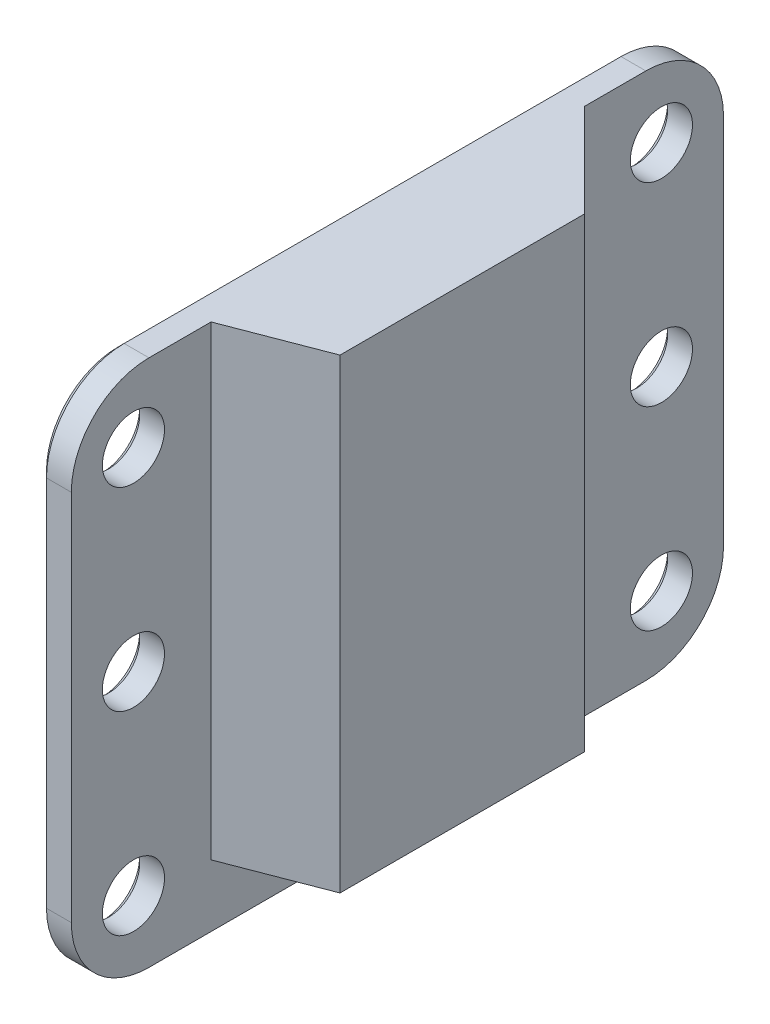
from build123d import *

# Parameters (mm, degrees)
SKETCH_1_R          = 1
EXTRUDE_1_DEPTH     = 1
CHAMFER_1_SIZE      = 0.2
CUT_EXTRUDE_1_DEPTH = 0.1
EXTRUDE_START       = -2
EXTRUDE_3_DEPTH     = 15


with BuildPart() as part:
    # Эскиз1 → Бобышка-Вытянуть1 (new body)
    with BuildSketch(Plane(origin=(0, 0, 0), x_dir=(0, 0, -1), z_dir=(1, 0, 0))):
        with BuildLine():
            Line((-8, -8.5), (8, -8.5))
            ThreePointArc((8, -8.5), (9.767766953, -7.767766953), (10.5, -6))
            Line((10.5, -6), (10.5, 6))
            ThreePointArc((10.5, 6), (9.767766953, 7.767766953), (8, 8.5))
            Line((8, 8.5), (-8, 8.5))
            ThreePointArc((-8, 8.5), (-9.767766953, 7.767766953), (-10.5, 6))
            Line((-10.5, 6), (-10.5, -6))
            ThreePointArc((-10.5, -6), (-9.767766953, -7.767766953), (-8, -8.5))
        make_face()
        with Locations((8.5, 6.25)):
            Circle(SKETCH_1_R, mode=Mode.SUBTRACT)
        with Locations((-8.5, 6.25)):
            Circle(SKETCH_1_R, mode=Mode.SUBTRACT)
        with Locations((-8.5, 0)):
            Circle(SKETCH_1_R, mode=Mode.SUBTRACT)
        with Locations((-8.5, -6.25)):
            Circle(SKETCH_1_R, mode=Mode.SUBTRACT)
        with Locations((8.5, 0)):
            Circle(SKETCH_1_R, mode=Mode.SUBTRACT)
        with Locations((8.5, -6.25)):
            Circle(SKETCH_1_R, mode=Mode.SUBTRACT)
    extrude(amount=EXTRUDE_1_DEPTH)

    # Фаска1
    chamfer_1_edges = [part.edges().sort_by_distance(p)[0] for p in [
        (0, 8.5, 0),
        (0, 7.767766953, -9.767766953),
        (0, 6.25, -7.5),
        (0, 6.25, 9.5),
        (0, 0, 9.5),
        (0, -6.25, 9.5),
        (0, 0, -7.5),
        (0, -6.25, -7.5),
        (0, 0, -10.5),
        (0, -7.767766953, -9.767766953),
        (0, -8.5, 0),
        (0, -7.767766953, 9.767766953),
        (0, 0, 10.5),
        (0, 7.767766953, 9.767766953),
    ]]
    chamfer(chamfer_1_edges, length=CHAMFER_1_SIZE)

    # Эскиз4 → Вырез-Вытянуть1 (cut)
    # profile 1 of 18: a face of its own
    with BuildSketch(Plane.ZY):
        with BuildLine():
            Line((-3.249352173, 2.01996498), (-2.916814332, 1.942498778))
            add(Edge.make_bspline(
                [(-2.916814332, 1.942498778), (-2.925145333, 1.91133093), (-2.941441805, 1.850362751), (-2.973661911, 1.763110537), (-3.009825027, 1.681228057), (-3.050808637, 1.604931002), (-3.0970613, 1.534658034), (-3.14735751, 1.469506009), (-3.203689426, 1.410841228), (-3.263990166, 1.357309736), (-3.328729234, 1.310095104), (-3.3971261, 1.269324402), (-3.468850149, 1.234636812), (-3.544191266, 1.206111867), (-3.623198296, 1.1846444), (-3.705464431, 1.168997653), (-3.791229552, 1.159360168), (-3.849689999, 1.158091365), (-3.879473595, 1.157444953)],
                knots=[0, 0, 0, 0, 1.145254194, 2.240259345, 3.299159039, 4.322497661, 5.312016644, 6.284080175, 7.241264552, 8.196044782, 9.144516039, 10.082428046, 11.020306713, 11.970622414, 12.939253955, 13.924100776, 14.94240044, 16, 16, 16, 16], degree=3))
            add(Edge.make_bspline(
                [(-3.879473595, 1.157444953), (-3.910032141, 1.157888914), (-3.969817495, 1.158757487), (-4.057399592, 1.165822236), (-4.140698765, 1.178074944), (-4.219559457, 1.195098327), (-4.294247103, 1.216146683), (-4.364451993, 1.242627379), (-4.430051162, 1.274349348), (-4.491591793, 1.310425425), (-4.548812502, 1.351409473), (-4.603014509, 1.396195444), (-4.652881968, 1.446016246), (-4.699661756, 1.499695564), (-4.74233499, 1.557941503), (-4.782471629, 1.619962766), (-4.818112627, 1.686852168), (-4.850578811, 1.757369575), (-4.879075075, 1.830832253), (-4.904284301, 1.90578911), (-4.924894221, 1.982389508), (-4.942638033, 2.059988866), (-4.955528052, 2.13924013), (-4.965762328, 2.219548673), (-4.971389339, 2.301406855), (-4.972129795, 2.356431328), (-4.972502808, 2.384150599)],
                knots=[0, 0, 0, 0, 1.180702053, 2.309949215, 3.392367133, 4.431746864, 5.425408375, 6.388154007, 7.326956194, 8.237882283, 9.141054626, 10.043899035, 10.951650021, 11.86168169, 12.792564695, 13.739356664, 14.713891418, 15.718426911, 16.737522708, 17.757217648, 18.772674716, 19.801476837, 20.831699174, 21.873853055, 22.928926693, 24, 24, 24, 24], degree=3))
            add(Edge.make_bspline(
                [(-4.972502808, 2.384150599), (-4.97196932, 2.41407467), (-4.970915282, 2.473197077), (-4.964965256, 2.560433904), (-4.954037215, 2.644628114), (-4.938861344, 2.725835089), (-4.919657796, 2.804120593), (-4.895953169, 2.879522769), (-4.868047325, 2.951945138), (-4.83602534, 3.021467563), (-4.799674465, 3.087313988), (-4.760079625, 3.14957802), (-4.716296331, 3.207237311), (-4.669622693, 3.261393458), (-4.618893005, 3.311144701), (-4.564262174, 3.356603737), (-4.506201531, 3.39818521), (-4.444719551, 3.435503096), (-4.380619874, 3.468247588), (-4.314854588, 3.497413392), (-4.247162115, 3.521318733), (-4.178079141, 3.541195063), (-4.107456937, 3.557018468), (-4.035130486, 3.567599629), (-3.961166618, 3.574495133), (-3.911294402, 3.575429639), (-3.886086564, 3.575901984)],
                knots=[0, 0, 0, 0, 1.185634383, 2.342514083, 3.462112933, 4.547331452, 5.613960142, 6.653690668, 7.676612054, 8.686959706, 9.683658101, 10.654407272, 11.607580201, 12.5494388, 13.484601218, 14.419076806, 15.362504069, 16.311442244, 17.265594461, 18.212500624, 19.159571152, 20.107257795, 21.059246075, 22.024387127, 23.001429356, 24, 24, 24, 24], degree=3))
            add(Edge.make_bspline(
                [(-3.886086564, 3.575901984), (-3.857882388, 3.575370349), (-3.802444288, 3.574325369), (-3.721098754, 3.565730196), (-3.64319097, 3.551334223), (-3.56838335, 3.532448068), (-3.497453653, 3.50658899), (-3.429631816, 3.475845518), (-3.365592531, 3.438910961), (-3.304837518, 3.396800347), (-3.248355776, 3.349436015), (-3.195356902, 3.297949484), (-3.148001913, 3.241053968), (-3.104415261, 3.180126439), (-3.06596833, 3.11432204), (-3.031246696, 3.044214516), (-3.0013871, 2.969282696), (-2.98541073, 2.917090611), (-2.977275757, 2.89051504)],
                knots=[0, 0, 0, 0, 1.098391872, 2.158997981, 3.181470371, 4.182549255, 5.160268219, 6.118029851, 7.079534476, 8.035645336, 8.993622929, 9.94770573, 10.909620999, 11.872786677, 12.862530088, 13.874594564, 14.917769567, 16, 16, 16, 16], degree=3))
            Line((-2.977275757, 2.89051504), (-3.309813599, 2.819189452))
            add(Edge.make_bspline(
                [(-3.309813599, 2.819189452), (-3.316344123, 2.839584838), (-3.32912638, 2.879504919), (-3.351822526, 2.93639813), (-3.376333608, 2.989213617), (-3.403243499, 3.037592366), (-3.432610518, 3.081545963), (-3.463758421, 3.1216086), (-3.497433481, 3.157032501), (-3.532950718, 3.188634455), (-3.571227293, 3.215556294), (-3.611365835, 3.239413475), (-3.654212667, 3.259151654), (-3.699151403, 3.275846076), (-3.746602083, 3.28855233), (-3.79637148, 3.29749168), (-3.848503323, 3.302665339), (-3.884028246, 3.303433693), (-3.90214663, 3.303825568)],
                knots=[0, 0, 0, 0, 1.235697765, 2.418642872, 3.532555292, 4.594392283, 5.610119701, 6.580908344, 7.519430642, 8.427315627, 9.319973334, 10.216139639, 11.118687699, 12.038725643, 12.980015607, 13.949697744, 14.954307006, 16, 16, 16, 16], degree=3))
            add(Edge.make_bspline(
                [(-3.90214663, 3.303825568), (-3.922948192, 3.303523758), (-3.963858726, 3.302930187), (-4.023961222, 3.296433616), (-4.081680523, 3.2868648), (-4.136586448, 3.272515539), (-4.188979447, 3.254625742), (-4.238548611, 3.232349779), (-4.285715597, 3.206239738), (-4.329953998, 3.176138824), (-4.370892029, 3.142299604), (-4.40964063, 3.106526253), (-4.44433944, 3.067150386), (-4.476311626, 3.025470378), (-4.50462616, 2.980749716), (-4.530113984, 2.933597548), (-4.552612633, 2.883627426), (-4.577137687, 2.813298264), (-4.602144267, 2.722715929), (-4.623837506, 2.611872511), (-4.637655588, 2.499282762), (-4.639193546, 2.423552845), (-4.639964966, 2.385567664)],
                knots=[0, 0, 0, 0, 0.935256702, 1.839373932, 2.716087708, 3.564631604, 4.388828665, 5.203538865, 6.005592122, 6.810952829, 7.606223804, 8.392839071, 9.180346482, 9.963639178, 10.753404291, 11.558266631, 12.372976832, 13.215232055, 14.905983541, 16.594894834, 18.292041732, 20, 20, 20, 20], degree=3))
            add(Edge.make_bspline(
                [(-4.639964966, 2.385567664), (-4.639094914, 2.337807655), (-4.637406933, 2.245148913), (-4.620750709, 2.11087109), (-4.595356011, 1.985626024), (-4.56470827, 1.887909919), (-4.533965506, 1.815832679), (-4.509102303, 1.765355949), (-4.480721949, 1.718647231), (-4.449530367, 1.675441262), (-4.415125776, 1.635864072), (-4.377987501, 1.599705424), (-4.338107248, 1.566617386), (-4.295012472, 1.538148871), (-4.250361946, 1.512871312), (-4.204719122, 1.490394023), (-4.158055264, 1.471383727), (-4.110182103, 1.456616144), (-4.061771906, 1.443854898), (-4.012291484, 1.435518654), (-3.961754948, 1.43081394), (-3.927820914, 1.42995568), (-3.910649018, 1.429521369)],
                knots=[0, 0, 0, 0, 2.10686522, 4.087509323, 5.961373225, 7.741398778, 8.594514555, 9.418024779, 10.222433421, 11.003575649, 11.767087398, 12.533660211, 13.289033706, 14.050297079, 14.809623433, 15.552362432, 16.294320901, 17.0305302, 17.761969017, 18.502233515, 19.242073914, 20, 20, 20, 20], degree=3))
            add(Edge.make_bspline(
                [(-3.910649018, 1.429521369), (-3.890156712, 1.429951136), (-3.849677161, 1.430800077), (-3.790329, 1.438230908), (-3.733118191, 1.44918121), (-3.678737834, 1.466078631), (-3.626456454, 1.486767543), (-3.576702405, 1.512280591), (-3.529632157, 1.54296534), (-3.484692061, 1.577804991), (-3.44271085, 1.61744656), (-3.404237328, 1.661570676), (-3.369722231, 1.710378494), (-3.337718051, 1.763086719), (-3.310828658, 1.821269941), (-3.285922731, 1.883193974), (-3.265169313, 1.949876596), (-3.254700292, 1.996266575), (-3.249352173, 2.01996498)],
                knots=[0, 0, 0, 0, 1.013374089, 2.001772144, 2.95501459, 3.891367103, 4.814208647, 5.733921849, 6.652182523, 7.590185968, 8.54346024, 9.504121027, 10.481158517, 11.497760682, 12.549996529, 13.647863555, 14.798406869, 16, 16, 16, 16], degree=3))
        make_face()
    # profile 2 of 18: a face of its own
    with BuildSketch(Plane.ZY):
        Polygon((-2.493584351, 3.545671271), (-0.649510865, 3.545671271), (-0.649510865, 1.187675666), (-0.982048707, 1.187675666), (-0.982048707, 3.273594855), (-2.161046509, 3.273594855), (-2.161046509, 1.187675666), (-2.493584351, 1.187675666), align=None)
    # profile 3 of 18: a face of its own
    with BuildSketch(Plane.ZY):
        with BuildLine():
            Line((1.07363977, 3.575901984), (1.315485473, 3.575901984))
            add(Edge.make_bspline(
                [(1.315485473, 3.575901984), (1.312088756, 3.552656002), (1.305772574, 3.50943019), (1.28913204, 3.45050963), (1.266707728, 3.40282379), (1.238497254, 3.365444279), (1.204448853, 3.338549554), (1.167623245, 3.315883249), (1.12557363, 3.300561699), (1.087273832, 3.290533535), (1.052119422, 3.286031807), (1.0196818, 3.282675585), (0.981554119, 3.279970172), (0.937618598, 3.277630002), (0.88801378, 3.275825787), (0.832590893, 3.274252445), (0.771489096, 3.274122514), (0.728820329, 3.273775437), (0.706620021, 3.273594855)],
                knots=[0, 0, 0, 0, 1.447688144, 2.691970396, 3.760160657, 4.68065666, 5.549582026, 6.420403723, 7.33633148, 8.297062735, 8.855889161, 9.519577379, 10.308145941, 11.212369725, 12.232534731, 13.368839418, 14.631022684, 16, 16, 16, 16], degree=3))
            add(Edge.make_bspline(
                [(0.706620021, 3.273594855), (0.677016233, 3.273462699), (0.620307242, 3.27320954), (0.538850824, 3.269954375), (0.464819612, 3.264270625), (0.397940426, 3.257019427), (0.338506346, 3.24714033), (0.286184821, 3.23556359), (0.241105066, 3.221773596), (0.191608602, 3.199868999), (0.138776675, 3.165527625), (0.08444511, 3.114434407), (0.040341034, 3.052189127), (0.006291732, 2.979163612), (-0.019196264, 2.896030541), (-0.038152816, 2.802344649), (-0.051449707, 2.697822177), (-0.054590173, 2.624306327), (-0.056233124, 2.585846137)],
                knots=[0, 0, 0, 0, 1.168085541, 2.237583686, 3.215849248, 4.097485846, 4.89110544, 5.591949054, 6.210901784, 6.747731092, 7.723151589, 8.681223594, 9.67429203, 10.713625422, 11.847384722, 13.097546203, 14.481566582, 16, 16, 16, 16], degree=3))
            add(Edge.make_bspline(
                [(-0.056233124, 2.585846137), (-0.037299391, 2.61399244), (-0.00047944, 2.668727843), (0.06320931, 2.741615823), (0.132138684, 2.802866996), (0.205371308, 2.853942306), (0.284024784, 2.892695271), (0.367137497, 2.921023547), (0.455283352, 2.93781609), (0.515716798, 2.939963483), (0.546491714, 2.941057013)],
                knots=[0, 0, 0, 0, 1.110237516, 2.159050787, 3.15987179, 4.123962007, 5.074118526, 6.021584412, 6.992518568, 8, 8, 8, 8], degree=3))
            add(Edge.make_bspline(
                [(0.546491714, 2.941057013), (0.574711697, 2.940322718), (0.630106072, 2.938881333), (0.711432129, 2.927766296), (0.789090641, 2.909622461), (0.862838527, 2.883161273), (0.933126156, 2.85035956), (0.999094415, 2.809046756), (1.061874732, 2.761291774), (1.12002707, 2.705981277), (1.17374021, 2.64506262), (1.219286982, 2.577318408), (1.25910249, 2.50536262), (1.290547368, 2.427503608), (1.315795756, 2.344898494), (1.332822347, 2.256694021), (1.344193537, 2.163701997), (1.345201362, 2.099828707), (1.345716186, 2.067200469)],
                knots=[0, 0, 0, 0, 1.016894964, 1.996112488, 2.952819316, 3.886231347, 4.815389333, 5.743038171, 6.686318772, 7.653872127, 8.631427155, 9.607399364, 10.590277588, 11.590453757, 12.628182697, 13.698908227, 14.824538844, 16, 16, 16, 16], degree=3))
            add(Edge.make_bspline(
                [(1.345716186, 2.067200469), (1.345343446, 2.042312798), (1.344616004, 1.993741734), (1.339227019, 1.922492322), (1.331046576, 1.85461796), (1.318736058, 1.790072028), (1.302747482, 1.729158025), (1.283155753, 1.671627796), (1.26088514, 1.617181366), (1.225571719, 1.550792012), (1.176635287, 1.47522552), (1.113136729, 1.392936845), (1.043081532, 1.322668318), (0.98026724, 1.272230277), (0.926198165, 1.238122488), (0.882082489, 1.216604611), (0.834768574, 1.197989656), (0.783722515, 1.183603245), (0.729485357, 1.17176732), (0.671584583, 1.163195581), (0.610172709, 1.158735467), (0.568068961, 1.157882222), (0.546491714, 1.157444953)],
                knots=[0, 0, 0, 0, 1.093762452, 2.134599383, 3.138882073, 4.097091642, 5.020300991, 5.904425602, 6.766805329, 7.602562305, 9.205481599, 10.718630349, 12.162195226, 13.556414138, 14.249622578, 14.967638063, 15.71043804, 16.481364025, 17.29579012, 18.149210177, 19.051510793, 20, 20, 20, 20], degree=3))
            add(Edge.make_bspline(
                [(0.546491714, 1.157444953), (0.521604701, 1.157971941), (0.473014078, 1.159000858), (0.402248421, 1.164847481), (0.335654189, 1.175858996), (0.273377188, 1.190776358), (0.215177471, 1.209990336), (0.16172711, 1.234528864), (0.111630527, 1.261904706), (0.052152087, 1.306016618), (-0.014928708, 1.368693148), (-0.086425564, 1.452976593), (-0.146717741, 1.547726922), (-0.190542813, 1.63383573), (-0.218674509, 1.712078257), (-0.236625092, 1.781559992), (-0.252732912, 1.860822317), (-0.265006875, 1.950150957), (-0.274900534, 2.049255949), (-0.281759957, 2.158442433), (-0.286007371, 2.277679187), (-0.286491244, 2.360528988), (-0.28674231, 2.40351715)],
                knots=[0, 0, 0, 0, 0.869969941, 1.698571965, 2.479373949, 3.226862343, 3.935175858, 4.617462302, 5.280294574, 5.926467779, 7.199986962, 8.481034777, 9.778573516, 11.11746889, 11.848611616, 12.680278358, 13.623591108, 14.674290727, 15.830289581, 17.104248661, 18.497485484, 20, 20, 20, 20], degree=3))
            add(Edge.make_bspline(
                [(-0.28674231, 2.40351715), (-0.286565995, 2.43107332), (-0.286221327, 2.484941198), (-0.283376225, 2.564171932), (-0.278498507, 2.639901483), (-0.272828897, 2.71228228), (-0.263843941, 2.7810257), (-0.254510629, 2.846552716), (-0.241822632, 2.908502424), (-0.228481556, 2.967083693), (-0.212703714, 3.02221035), (-0.195445265, 3.073997593), (-0.176192734, 3.122343433), (-0.154559188, 3.166888175), (-0.132331731, 3.208681407), (-0.107208463, 3.246535406), (-0.079968268, 3.280634393), (-0.042272519, 3.322507256), (0.011445168, 3.368498267), (0.082997737, 3.416326091), (0.16251316, 3.456560664), (0.249848134, 3.48920207), (0.344984796, 3.514383963), (0.447966332, 3.532759831), (0.558857919, 3.543543215), (0.635427647, 3.544946528), (0.674972244, 3.545671271)],
                knots=[0, 0, 0, 0, 1.138725006, 2.226024134, 3.27560146, 4.274694493, 5.225389509, 6.140066799, 7.00905395, 7.837640171, 8.622350396, 9.377477616, 10.092757112, 10.770847137, 11.423064358, 12.047458307, 12.644965996, 13.225329156, 14.373606024, 15.555619911, 16.774869453, 18.04739986, 19.401596195, 20.836144773, 22.36602033, 24, 24, 24, 24], degree=3))
            add(Edge.make_bspline(
                [(0.674972244, 3.545671271), (0.69890509, 3.545621592), (0.744094667, 3.545527789), (0.807861354, 3.54614524), (0.8634429, 3.546548512), (0.910675848, 3.547111565), (0.949735099, 3.54731973), (0.980584643, 3.54846646), (1.003294832, 3.549059885), (1.021953362, 3.550825689), (1.038214633, 3.554011509), (1.053688262, 3.559136304), (1.066236164, 3.565765567), (1.07130699, 3.572708131), (1.07363977, 3.575901984)],
                knots=[0, 0, 0, 0, 2.121263571, 4.005332245, 5.652161781, 7.047799696, 8.192250662, 9.113748436, 9.784202377, 10.204960964, 10.774243297, 11.246473532, 11.653348066, 12, 12, 12, 12], degree=3))
        make_face()
        with BuildLine():
            add(Edge.make_bspline(
                [(1.043409057, 2.077592276), (1.043092012, 2.09870633), (1.042468343, 2.140240455), (1.03621392, 2.201034059), (1.026021537, 2.258897533), (1.011053921, 2.313593236), (0.992972549, 2.365627489), (0.970065755, 2.414612946), (0.943051972, 2.460656198), (0.912066628, 2.503385644), (0.877548377, 2.542465222), (0.839338304, 2.576644928), (0.797395312, 2.605056465), (0.752262132, 2.628588652), (0.703782386, 2.647021758), (0.651682166, 2.65944921), (0.596529696, 2.668013592), (0.558493071, 2.66865221), (0.538934036, 2.668980597)],
                knots=[0, 0, 0, 0, 1.15537806, 2.272780892, 3.341182633, 4.367675389, 5.373518875, 6.352872391, 7.322507778, 8.291338504, 9.237517906, 10.171529833, 11.089458683, 12.003048188, 12.952245089, 13.920040268, 14.930451774, 16, 16, 16, 16], degree=3))
            add(Edge.make_bspline(
                [(0.538934036, 2.668980597), (0.51859524, 2.668428883), (0.479012406, 2.667355151), (0.421362661, 2.659223324), (0.367238579, 2.645718465), (0.31680807, 2.626023726), (0.269594212, 2.601597479), (0.226421099, 2.570859003), (0.186357972, 2.535332323), (0.150493897, 2.494098526), (0.119239907, 2.448059878), (0.090872177, 2.39892778), (0.068053428, 2.345458455), (0.04832375, 2.288768999), (0.034137113, 2.227898498), (0.023019795, 2.16374943), (0.017111393, 2.095808555), (0.01608901, 2.049418222), (0.015564819, 2.025633239)],
                knots=[0, 0, 0, 0, 1.041109151, 2.026179401, 2.974506738, 3.890765475, 4.792293325, 5.68919533, 6.597045231, 7.528360211, 8.478775586, 9.442737239, 10.428302209, 11.450638613, 12.512393947, 13.624380747, 14.781986208, 16, 16, 16, 16], degree=3))
            add(Edge.make_bspline(
                [(0.015564819, 2.025633239), (0.015981477, 2.002152617), (0.016788866, 1.956652473), (0.024071006, 1.890482276), (0.035610845, 1.828469483), (0.052334187, 1.7707026), (0.072665454, 1.716815903), (0.099274082, 1.667961482), (0.129297833, 1.622480144), (0.16488998, 1.582186815), (0.203659534, 1.546308098), (0.244690357, 1.514942183), (0.288258639, 1.488878358), (0.333583115, 1.466744768), (0.381658732, 1.450578166), (0.431474787, 1.437908919), (0.483624971, 1.430883989), (0.519075791, 1.429979715), (0.537044616, 1.429521369)],
                knots=[0, 0, 0, 0, 1.262192826, 2.445844726, 3.574949377, 4.649506094, 5.676168281, 6.66473662, 7.634528448, 8.600617636, 9.547181801, 10.471718694, 11.37194053, 12.273196875, 13.178183503, 14.093995951, 15.033910812, 16, 16, 16, 16], degree=3))
            add(Edge.make_bspline(
                [(0.537044616, 1.429521369), (0.555345334, 1.430037465), (0.59136302, 1.431053196), (0.643919954, 1.43990681), (0.694073324, 1.453501994), (0.741535352, 1.472965148), (0.786311989, 1.49815804), (0.82798723, 1.529328206), (0.867531351, 1.565301526), (0.903653557, 1.607037953), (0.936631485, 1.652925874), (0.964981021, 1.703152767), (0.989791568, 1.756539452), (1.009497478, 1.813878629), (1.024567944, 1.874767973), (1.035312751, 1.939200118), (1.042021286, 2.007227787), (1.042939837, 2.053801311), (1.043409057, 2.077592276)],
                knots=[0, 0, 0, 0, 0.952153412, 1.873935318, 2.766872554, 3.652821659, 4.537404495, 5.434208823, 6.35671941, 7.315238283, 8.302455356, 9.293781818, 10.313443325, 11.363364946, 12.444906477, 13.575564046, 14.761535198, 16, 16, 16, 16], degree=3))
        make_face(mode=Mode.SUBTRACT)
    # profile 4 of 18: a face of its own
    with BuildSketch(Plane.ZY):
        Polygon((1.738715454, 3.545671271), (3.58278894, 3.545671271), (3.58278894, 1.187675666), (3.250251098, 1.187675666), (3.250251098, 3.273594855), (2.071253295, 3.273594855), (2.071253295, 1.187675666), (1.738715454, 1.187675666), align=None)
    # profile 5 of 18: a face of its own
    with BuildSketch(Plane.ZY):
        with BuildLine():
            Line((3.930442138, 3.545671271), (4.232276912, 3.545671271))
            Line((4.232276912, 3.545671271), (4.954979892, 2.122938346))
            Line((4.954979892, 2.122938346), (5.626196189, 3.545671271))
            Line((5.626196189, 3.545671271), (5.925669189, 3.545671271))
            Line((5.925669189, 3.545671271), (5.027722545, 1.713406657))
            add(Edge.make_bspline(
                [(5.027722545, 1.713406657), (5.015204206, 1.685974077), (4.991166318, 1.633297658), (4.955488333, 1.558385887), (4.921431427, 1.490909615), (4.88879888, 1.430999105), (4.858472072, 1.378150269), (4.829553017, 1.332838036), (4.802339194, 1.295094431), (4.776472805, 1.263623071), (4.749344392, 1.238154479), (4.720707087, 1.216284711), (4.688916567, 1.198351665), (4.654929578, 1.182899253), (4.617781319, 1.172030392), (4.578405081, 1.163135883), (4.536255135, 1.158753714), (4.507352074, 1.157888314), (4.492544456, 1.157444953)],
                knots=[0, 0, 0, 0, 1.747301927, 3.355193374, 4.807802683, 6.126503253, 7.30799463, 8.33805797, 9.239610132, 10.00361817, 10.694201968, 11.39126463, 12.086114484, 12.80498857, 13.549573236, 14.324454107, 15.141584252, 16, 16, 16, 16], degree=3))
            add(Edge.make_bspline(
                [(4.492544456, 1.157444953), (4.472817887, 1.158262809), (4.430876247, 1.160001695), (4.365153975, 1.172293522), (4.293011414, 1.191247674), (4.243651612, 1.208704718), (4.217633911, 1.217906379)],
                knots=[0, 0, 0, 0, 0.836880998, 1.779334376, 2.829480454, 4, 4, 4, 4], degree=3))
            Line((4.217633911, 1.217906379), (4.217633911, 1.489982795))
            add(Edge.make_bspline(
                [(4.217633911, 1.489982795), (4.236952409, 1.480660491), (4.275176436, 1.462215167), (4.335917901, 1.443510319), (4.39807925, 1.431659805), (4.440216855, 1.430236059), (4.461369033, 1.429521369)],
                knots=[0, 0, 0, 0, 1.014175963, 2.006671956, 2.999391851, 4, 4, 4, 4], degree=3))
            add(Edge.make_bspline(
                [(4.461369033, 1.429521369), (4.478313398, 1.430243778), (4.511492905, 1.431658358), (4.559241392, 1.445664545), (4.603263981, 1.467657433), (4.637206885, 1.49324705), (4.662463829, 1.520029656), (4.682406993, 1.545696605), (4.701992398, 1.577357186), (4.72270471, 1.614038181), (4.743966264, 1.656287769), (4.765598112, 1.704075372), (4.787801702, 1.757481854), (4.802050234, 1.795237154), (4.809494586, 1.814962958)],
                knots=[0, 0, 0, 0, 1.090750356, 2.135846249, 3.180695278, 4.253417038, 4.856945926, 5.551864047, 6.34653332, 7.25623269, 8.269292152, 9.396653603, 10.639843932, 12, 12, 12, 12], degree=3))
            Line((4.809494586, 1.814962958), (3.930442138, 3.545671271))
        make_face()
    # profile 6 of 18: a face of its own
    with BuildSketch(Plane.ZY):
        with BuildLine():
            Line((-6.35938247, -3.577840192), (-6.157844384, -3.557686383))
            add(Edge.make_bspline(
                [(-6.157844384, -3.557686383), (-6.15515764, -3.569795985), (-6.149958989, -3.593227166), (-6.139956151, -3.626794768), (-6.129390957, -3.657953008), (-6.116293348, -3.686004952), (-6.103512928, -3.712097808), (-6.088493999, -3.735153444), (-6.072445982, -3.755773412), (-6.055072203, -3.773881145), (-6.03617246, -3.789474115), (-6.015998728, -3.803118804), (-5.994124353, -3.814513957), (-5.970716808, -3.823536141), (-5.945973243, -3.830839676), (-5.919759188, -3.836202529), (-5.891936028, -3.839397248), (-5.87286551, -3.839689812), (-5.863094933, -3.839839704)],
                knots=[0, 0, 0, 0, 1.321063709, 2.556160278, 3.730472002, 4.821700466, 5.852032229, 6.822994757, 7.746964065, 8.632786469, 9.490489437, 10.352773447, 11.223141997, 12.11199479, 13.021433979, 13.96892724, 14.959401504, 16, 16, 16, 16], degree=3))
            add(Edge.make_bspline(
                [(-5.863094933, -3.839839704), (-5.851634393, -3.839676304), (-5.82925194, -3.839357185), (-5.796637014, -3.834569172), (-5.765598159, -3.827994775), (-5.73657822, -3.817685744), (-5.709173109, -3.805086201), (-5.683538953, -3.78951584), (-5.65950029, -3.77123234), (-5.637531264, -3.750111334), (-5.617884419, -3.726877555), (-5.600386143, -3.702336754), (-5.585917419, -3.676279532), (-5.573722464, -3.649072914), (-5.564720992, -3.620277252), (-5.558131189, -3.590251615), (-5.553824718, -3.558860214), (-5.553431043, -3.537442031), (-5.553230126, -3.526510961)],
                knots=[0, 0, 0, 0, 1.111377895, 2.170522867, 3.193923215, 4.186422864, 5.152846954, 6.117443035, 7.091571248, 8.078879332, 9.069127402, 10.041602243, 10.999610288, 11.957618333, 12.930786866, 13.922135183, 14.939532534, 16, 16, 16, 16], degree=3))
            add(Edge.make_bspline(
                [(-5.553230126, -3.526510961), (-5.553466263, -3.516108378), (-5.553928246, -3.495756555), (-5.557726119, -3.465884444), (-5.564353323, -3.437527754), (-5.573540213, -3.410522374), (-5.585279173, -3.38490795), (-5.599389056, -3.360472675), (-5.616646601, -3.337752048), (-5.636071489, -3.31650203), (-5.657258374, -3.296924667), (-5.680444167, -3.2802716), (-5.704844334, -3.265899461), (-5.73074967, -3.25429452), (-5.758052616, -3.245083612), (-5.786727143, -3.238463552), (-5.816911112, -3.234664031), (-5.837472057, -3.234201967), (-5.847979577, -3.233965833)],
                knots=[0, 0, 0, 0, 1.072815875, 2.098878726, 3.09954706, 4.07199174, 5.036203424, 6.001873089, 6.97636515, 7.972747947, 8.969130744, 9.945905975, 10.911575641, 11.885646534, 12.868345115, 13.879560892, 14.916365174, 16, 16, 16, 16], degree=3))
            add(Edge.make_bspline(
                [(-5.847979577, -3.233965833), (-5.85723081, -3.234210927), (-5.876864083, -3.234731074), (-5.907851958, -3.239323778), (-5.942176279, -3.245754639), (-5.965895364, -3.252065576), (-5.978349526, -3.255379255)],
                knots=[0, 0, 0, 0, 0.837610211, 1.777604146, 2.833088267, 4, 4, 4, 4], degree=3))
            Line((-5.978349526, -3.255379255), (-5.957565911, -3.073994977))
            add(Edge.make_bspline(
                [(-5.957565911, -3.073994977), (-5.952112776, -3.074590856), (-5.942478965, -3.075643568), (-5.932796571, -3.076031119), (-5.928594811, -3.0761993)],
                knots=[0, 0, 0, 0, 1.132082448, 2, 2, 2, 2], degree=3))
            add(Edge.make_bspline(
                [(-5.928594811, -3.0761993), (-5.910059981, -3.075491647), (-5.873700471, -3.074103455), (-5.820695354, -3.062568742), (-5.770462048, -3.044407708), (-5.731653575, -3.022738959), (-5.702874522, -3.002358324), (-5.68472703, -2.98398229), (-5.66836613, -2.964481607), (-5.656159562, -2.942113616), (-5.645613839, -2.918347086), (-5.639083425, -2.89224579), (-5.634320912, -2.864444181), (-5.634006724, -2.845188032), (-5.63384536, -2.835298307)],
                knots=[0, 0, 0, 0, 1.557468908, 3.055264441, 4.54122591, 6.035034992, 6.780215604, 7.498173296, 8.201377046, 8.913174237, 9.633083494, 10.382644491, 11.169345745, 12, 12, 12, 12], degree=3))
            add(Edge.make_bspline(
                [(-5.63384536, -2.835298307), (-5.633994287, -2.827310042), (-5.634285545, -2.811687249), (-5.637530295, -2.788782586), (-5.642896712, -2.767079712), (-5.650149958, -2.7463469), (-5.659656057, -2.726692809), (-5.671444367, -2.708141498), (-5.684912911, -2.690316639), (-5.70081205, -2.674139304), (-5.717838649, -2.65895119), (-5.736613598, -2.646159682), (-5.756243348, -2.634796308), (-5.777420198, -2.626209537), (-5.799621341, -2.619149811), (-5.823036554, -2.614202641), (-5.847674384, -2.610880284), (-5.864553069, -2.610600332), (-5.873171837, -2.61045738)],
                knots=[0, 0, 0, 0, 1.041493611, 2.036867705, 3.009952345, 3.954088258, 4.897230656, 5.850851638, 6.817653571, 7.805463921, 8.805067469, 9.788883576, 10.763797054, 11.758134544, 12.762883247, 13.799594994, 14.876406454, 16, 16, 16, 16], degree=3))
            add(Edge.make_bspline(
                [(-5.873171837, -2.61045738), (-5.89003855, -2.61111504), (-5.922610671, -2.612385081), (-5.969244691, -2.624135592), (-6.011503533, -2.643149448), (-6.042789942, -2.665447394), (-6.065006044, -2.68676549), (-6.080180818, -2.704835036), (-6.093753794, -2.724789083), (-6.105763439, -2.746620521), (-6.1160475, -2.770417146), (-6.125318296, -2.795884155), (-6.132494752, -2.823429273), (-6.135929275, -2.842515325), (-6.137690575, -2.852303083)],
                knots=[0, 0, 0, 0, 1.533565899, 2.961543033, 4.347411787, 5.731829577, 6.434842101, 7.147085226, 7.87612511, 8.629021686, 9.412189982, 10.234506416, 11.094615066, 12, 12, 12, 12], degree=3))
            Line((-6.137690575, -2.852303083), (-6.339228661, -2.832149274))
            add(Edge.make_bspline(
                [(-6.339228661, -2.832149274), (-6.336076004, -2.81656613), (-6.329891819, -2.785998566), (-6.317292619, -2.741850674), (-6.301928051, -2.700408376), (-6.283480305, -2.661861675), (-6.262820912, -2.62574926), (-6.238988803, -2.592499478), (-6.212542722, -2.561914656), (-6.183435695, -2.534088083), (-6.152062866, -2.50923584), (-6.118582251, -2.48779752), (-6.083268614, -2.469625454), (-6.046088892, -2.454975554), (-6.007072523, -2.443062965), (-5.966108506, -2.435170846), (-5.923382259, -2.429832225), (-5.894287426, -2.429329256), (-5.879469903, -2.429073102)],
                knots=[0, 0, 0, 0, 1.136581168, 2.229493434, 3.279335563, 4.293305329, 5.282068175, 6.250623624, 7.213783178, 8.169396253, 9.125981663, 10.071280146, 11.007896369, 11.961295906, 12.925420184, 13.920544621, 14.940967302, 16, 16, 16, 16], degree=3))
            add(Edge.make_bspline(
                [(-5.879469903, -2.429073102), (-5.858958923, -2.429738223), (-5.818627704, -2.431046065), (-5.759390543, -2.441433105), (-5.702730511, -2.458478446), (-5.649103546, -2.482106328), (-5.599432273, -2.510978977), (-5.55547729, -2.545581087), (-5.517826217, -2.585314051), (-5.487210341, -2.629743472), (-5.462966862, -2.677047528), (-5.445027417, -2.72615119), (-5.434308329, -2.776997932), (-5.432975649, -2.811421164), (-5.432307274, -2.828685338)],
                knots=[0, 0, 0, 0, 1.104647871, 2.172094857, 3.229560912, 4.285649672, 5.322588163, 6.317201348, 7.289435229, 8.260615662, 9.214246199, 10.146367077, 11.070353327, 12, 12, 12, 12], degree=3))
            add(Edge.make_bspline(
                [(-5.432307274, -2.828685338), (-5.432984873, -2.84500511), (-5.434322758, -2.877227716), (-5.444622895, -2.924342875), (-5.462028077, -2.96897919), (-5.485553348, -3.01129327), (-5.516059853, -3.050370039), (-5.553463798, -3.085191001), (-5.59716682, -3.116089342), (-5.629918539, -3.132171586), (-5.646756394, -3.140439565)],
                knots=[0, 0, 0, 0, 0.975609618, 1.926294443, 2.868398979, 3.832526731, 4.812148358, 5.820404151, 6.879456693, 8, 8, 8, 8], degree=3))
            add(Edge.make_bspline(
                [(-5.646756394, -3.140439565), (-5.635467736, -3.143289728), (-5.613356549, -3.148872365), (-5.58159987, -3.160439432), (-5.551745027, -3.173981557), (-5.52339467, -3.189319608), (-5.497371865, -3.207459339), (-5.472779627, -3.227293078), (-5.4505476, -3.249776033), (-5.430031684, -3.27410687), (-5.411364718, -3.300030964), (-5.395656284, -3.328052596), (-5.382100362, -3.357435128), (-5.37054116, -3.388391668), (-5.362234744, -3.421160917), (-5.356295394, -3.45548901), (-5.352375907, -3.491256679), (-5.35192223, -3.515688888), (-5.35169204, -3.528085477)],
                knots=[0, 0, 0, 0, 1.053251915, 2.063013066, 3.05373318, 4.018979697, 4.975584284, 5.920798056, 6.874756953, 7.832116109, 8.799604348, 9.761196922, 10.734637845, 11.72654167, 12.747371341, 13.789206138, 14.878271633, 16, 16, 16, 16], degree=3))
            add(Edge.make_bspline(
                [(-5.35169204, -3.528085477), (-5.35207562, -3.545009803), (-5.352829477, -3.578271533), (-5.359976068, -3.627133772), (-5.371655202, -3.673950366), (-5.387817556, -3.718880295), (-5.408297816, -3.762106927), (-5.433997165, -3.803020259), (-5.464153932, -3.841952863), (-5.498296658, -3.878531973), (-5.535703282, -3.9121493), (-5.576325445, -3.941258691), (-5.61935944, -3.965978845), (-5.664875298, -3.986138008), (-5.712752358, -4.00197614), (-5.763038246, -4.013329418), (-5.815888573, -4.020001857), (-5.851949144, -4.020811245), (-5.870337708, -4.021223981)],
                knots=[0, 0, 0, 0, 1.016055063, 1.996874249, 2.958724482, 3.910019225, 4.860394196, 5.826121543, 6.806008102, 7.814207964, 8.82789325, 9.821757317, 10.810247154, 11.803791187, 12.806673825, 13.834534493, 14.895752369, 16, 16, 16, 16], degree=3))
            add(Edge.make_bspline(
                [(-5.870337708, -4.021223981), (-5.886839918, -4.020913147), (-5.919327162, -4.020301219), (-5.96688178, -4.013925975), (-6.012441575, -4.004878771), (-6.055646288, -3.990931419), (-6.096997778, -3.973922849), (-6.135795702, -3.952162949), (-6.172737675, -3.927183428), (-6.20713016, -3.898270613), (-6.238782155, -3.866358422), (-6.26701952, -3.831918866), (-6.291267138, -3.795028409), (-6.312646167, -3.756239003), (-6.329925951, -3.714819449), (-6.343380998, -3.671125361), (-6.353640653, -3.625318899), (-6.357447706, -3.593838626), (-6.35938247, -3.577840192)],
                knots=[0, 0, 0, 0, 1.08471039, 2.135426191, 3.150939737, 4.135689946, 5.116584603, 6.086901885, 7.055842759, 8.045878862, 9.036901429, 10.008421467, 10.96965771, 11.936653536, 12.917548193, 13.915472582, 14.940632654, 16, 16, 16, 16], degree=3))
        make_face()
    # profile 7 of 18: a face of its own
    with BuildSketch(Plane.ZY):
        with BuildLine():
            Line((-5.150153954, -3.577840192), (-4.948615868, -3.557686383))
            add(Edge.make_bspline(
                [(-4.948615868, -3.557686383), (-4.945929124, -3.569795985), (-4.940730474, -3.593227166), (-4.930727635, -3.626794768), (-4.920162441, -3.657953008), (-4.907064832, -3.686004952), (-4.894284412, -3.712097808), (-4.879265483, -3.735153444), (-4.863217466, -3.755773412), (-4.845843687, -3.773881145), (-4.826943944, -3.789474115), (-4.806770213, -3.803118804), (-4.784895837, -3.814513957), (-4.761488293, -3.823536141), (-4.736744728, -3.830839676), (-4.710530673, -3.836202529), (-4.682707512, -3.839397248), (-4.663636994, -3.839689812), (-4.653866418, -3.839839704)],
                knots=[0, 0, 0, 0, 1.321063709, 2.556160278, 3.730472002, 4.821700466, 5.852032229, 6.822994757, 7.746964065, 8.632786469, 9.490489437, 10.352773447, 11.223141997, 12.11199479, 13.021433979, 13.96892724, 14.959401504, 16, 16, 16, 16], degree=3))
            add(Edge.make_bspline(
                [(-4.653866418, -3.839839704), (-4.642405878, -3.839676304), (-4.620023424, -3.839357185), (-4.587408498, -3.834569172), (-4.556369644, -3.827994775), (-4.527349704, -3.817685744), (-4.499944593, -3.805086201), (-4.474310438, -3.78951584), (-4.450271775, -3.77123234), (-4.428302749, -3.750111334), (-4.408655903, -3.726877555), (-4.391157627, -3.702336754), (-4.376688904, -3.676279532), (-4.364493949, -3.649072914), (-4.355492477, -3.620277252), (-4.348902673, -3.590251615), (-4.344596202, -3.558860214), (-4.344202528, -3.537442031), (-4.34400161, -3.526510961)],
                knots=[0, 0, 0, 0, 1.111377895, 2.170522867, 3.193923215, 4.186422864, 5.152846954, 6.117443035, 7.091571248, 8.078879332, 9.069127402, 10.041602243, 10.999610288, 11.957618333, 12.930786866, 13.922135183, 14.939532534, 16, 16, 16, 16], degree=3))
            add(Edge.make_bspline(
                [(-4.34400161, -3.526510961), (-4.344237747, -3.516108378), (-4.34469973, -3.495756555), (-4.348497603, -3.465884444), (-4.355124808, -3.437527754), (-4.364311698, -3.410522374), (-4.376050657, -3.38490795), (-4.390160541, -3.360472675), (-4.407418085, -3.337752048), (-4.426842973, -3.31650203), (-4.448029859, -3.296924667), (-4.471215651, -3.2802716), (-4.495615818, -3.265899461), (-4.521521155, -3.25429452), (-4.5488241, -3.245083612), (-4.577498627, -3.238463552), (-4.607682596, -3.234664031), (-4.628243541, -3.234201967), (-4.638751061, -3.233965833)],
                knots=[0, 0, 0, 0, 1.072815875, 2.098878726, 3.09954706, 4.07199174, 5.036203424, 6.001873089, 6.97636515, 7.972747947, 8.969130744, 9.945905975, 10.911575641, 11.885646534, 12.868345115, 13.879560892, 14.916365174, 16, 16, 16, 16], degree=3))
            add(Edge.make_bspline(
                [(-4.638751061, -3.233965833), (-4.648002294, -3.234210927), (-4.667635567, -3.234731074), (-4.698623442, -3.239323778), (-4.732947763, -3.245754639), (-4.756666848, -3.252065576), (-4.76912101, -3.255379255)],
                knots=[0, 0, 0, 0, 0.837610211, 1.777604146, 2.833088267, 4, 4, 4, 4], degree=3))
            Line((-4.76912101, -3.255379255), (-4.748337395, -3.073994977))
            add(Edge.make_bspline(
                [(-4.748337395, -3.073994977), (-4.742884261, -3.074590856), (-4.733250449, -3.075643568), (-4.723568055, -3.076031119), (-4.719366295, -3.0761993)],
                knots=[0, 0, 0, 0, 1.132082448, 2, 2, 2, 2], degree=3))
            add(Edge.make_bspline(
                [(-4.719366295, -3.0761993), (-4.700831466, -3.075491647), (-4.664471955, -3.074103455), (-4.611466838, -3.062568742), (-4.561233533, -3.044407708), (-4.522425059, -3.022738959), (-4.493646007, -3.002358324), (-4.475498515, -2.98398229), (-4.459137615, -2.964481607), (-4.446931046, -2.942113616), (-4.436385324, -2.918347086), (-4.429854909, -2.89224579), (-4.425092397, -2.864444181), (-4.424778208, -2.845188032), (-4.424616845, -2.835298307)],
                knots=[0, 0, 0, 0, 1.557468908, 3.055264441, 4.54122591, 6.035034992, 6.780215604, 7.498173296, 8.201377046, 8.913174237, 9.633083494, 10.382644491, 11.169345745, 12, 12, 12, 12], degree=3))
            add(Edge.make_bspline(
                [(-4.424616845, -2.835298307), (-4.424765771, -2.827310042), (-4.42505703, -2.811687249), (-4.428301779, -2.788782586), (-4.433668196, -2.767079712), (-4.440921442, -2.7463469), (-4.450427542, -2.726692809), (-4.462215851, -2.708141498), (-4.475684395, -2.690316639), (-4.491583535, -2.674139304), (-4.508610133, -2.65895119), (-4.527385082, -2.646159682), (-4.547014833, -2.634796308), (-4.568191683, -2.626209537), (-4.590392825, -2.619149811), (-4.613808038, -2.614202641), (-4.638445868, -2.610880284), (-4.655324553, -2.610600332), (-4.663943322, -2.61045738)],
                knots=[0, 0, 0, 0, 1.041493611, 2.036867705, 3.009952345, 3.954088258, 4.897230656, 5.850851638, 6.817653571, 7.805463921, 8.805067469, 9.788883576, 10.763797054, 11.758134544, 12.762883247, 13.799594994, 14.876406454, 16, 16, 16, 16], degree=3))
            add(Edge.make_bspline(
                [(-4.663943322, -2.61045738), (-4.680810034, -2.61111504), (-4.713382156, -2.612385081), (-4.760016176, -2.624135592), (-4.802275018, -2.643149448), (-4.833561427, -2.665447394), (-4.855777528, -2.68676549), (-4.870952303, -2.704835036), (-4.884525278, -2.724789083), (-4.896534923, -2.746620521), (-4.906818985, -2.770417146), (-4.91608978, -2.795884155), (-4.923266236, -2.823429273), (-4.926700759, -2.842515325), (-4.92846206, -2.852303083)],
                knots=[0, 0, 0, 0, 1.533565899, 2.961543033, 4.347411787, 5.731829577, 6.434842101, 7.147085226, 7.87612511, 8.629021686, 9.412189982, 10.234506416, 11.094615066, 12, 12, 12, 12], degree=3))
            Line((-4.92846206, -2.852303083), (-5.130000146, -2.832149274))
            add(Edge.make_bspline(
                [(-5.130000146, -2.832149274), (-5.126847488, -2.81656613), (-5.120663303, -2.785998566), (-5.108064103, -2.741850674), (-5.092699535, -2.700408376), (-5.07425179, -2.661861675), (-5.053592396, -2.62574926), (-5.029760287, -2.592499478), (-5.003314207, -2.561914656), (-4.974207179, -2.534088083), (-4.94283435, -2.50923584), (-4.909353736, -2.48779752), (-4.874040099, -2.469625454), (-4.836860377, -2.454975554), (-4.797844007, -2.443062965), (-4.75687999, -2.435170846), (-4.714153743, -2.429832225), (-4.685058911, -2.429329256), (-4.670241387, -2.429073102)],
                knots=[0, 0, 0, 0, 1.136581168, 2.229493434, 3.279335563, 4.293305329, 5.282068175, 6.250623624, 7.213783178, 8.169396253, 9.125981663, 10.071280146, 11.007896369, 11.961295906, 12.925420184, 13.920544621, 14.940967302, 16, 16, 16, 16], degree=3))
            add(Edge.make_bspline(
                [(-4.670241387, -2.429073102), (-4.649730407, -2.429738223), (-4.609399189, -2.431046065), (-4.550162028, -2.441433105), (-4.493501995, -2.458478446), (-4.43987503, -2.482106328), (-4.390203757, -2.510978977), (-4.346248774, -2.545581087), (-4.308597701, -2.585314051), (-4.277981825, -2.629743472), (-4.253738347, -2.677047528), (-4.235798901, -2.72615119), (-4.225079813, -2.776997932), (-4.223747134, -2.811421164), (-4.223078759, -2.828685338)],
                knots=[0, 0, 0, 0, 1.104647871, 2.172094857, 3.229560912, 4.285649672, 5.322588163, 6.317201348, 7.289435229, 8.260615662, 9.214246199, 10.146367077, 11.070353327, 12, 12, 12, 12], degree=3))
            add(Edge.make_bspline(
                [(-4.223078759, -2.828685338), (-4.223756357, -2.84500511), (-4.225094243, -2.877227716), (-4.235394379, -2.924342875), (-4.252799561, -2.96897919), (-4.276324833, -3.01129327), (-4.306831337, -3.050370039), (-4.344235283, -3.085191001), (-4.387938305, -3.116089342), (-4.420690023, -3.132171586), (-4.437527878, -3.140439565)],
                knots=[0, 0, 0, 0, 0.975609618, 1.926294443, 2.868398979, 3.832526731, 4.812148358, 5.820404151, 6.879456693, 8, 8, 8, 8], degree=3))
            add(Edge.make_bspline(
                [(-4.437527878, -3.140439565), (-4.42623922, -3.143289728), (-4.404128033, -3.148872365), (-4.372371354, -3.160439432), (-4.342516511, -3.173981557), (-4.314166154, -3.189319608), (-4.288143349, -3.207459339), (-4.263551111, -3.227293078), (-4.241319085, -3.249776033), (-4.220803168, -3.27410687), (-4.202136203, -3.300030964), (-4.186427769, -3.328052596), (-4.172871846, -3.357435128), (-4.161312645, -3.388391668), (-4.153006228, -3.421160917), (-4.147066878, -3.45548901), (-4.143147392, -3.491256679), (-4.142693714, -3.515688888), (-4.142463524, -3.528085477)],
                knots=[0, 0, 0, 0, 1.053251915, 2.063013066, 3.05373318, 4.018979697, 4.975584284, 5.920798056, 6.874756953, 7.832116109, 8.799604348, 9.761196922, 10.734637845, 11.72654167, 12.747371341, 13.789206138, 14.878271633, 16, 16, 16, 16], degree=3))
            add(Edge.make_bspline(
                [(-4.142463524, -3.528085477), (-4.142847104, -3.545009803), (-4.143600962, -3.578271533), (-4.150747552, -3.627133772), (-4.162426686, -3.673950366), (-4.17858904, -3.718880295), (-4.1990693, -3.762106927), (-4.224768649, -3.803020259), (-4.254925416, -3.841952863), (-4.289068142, -3.878531973), (-4.326474767, -3.9121493), (-4.367096929, -3.941258691), (-4.410130924, -3.965978845), (-4.455646782, -3.986138008), (-4.503523842, -4.00197614), (-4.553809731, -4.013329418), (-4.606660057, -4.020001857), (-4.642720629, -4.020811245), (-4.661109193, -4.021223981)],
                knots=[0, 0, 0, 0, 1.016055063, 1.996874249, 2.958724482, 3.910019225, 4.860394196, 5.826121543, 6.806008102, 7.814207964, 8.82789325, 9.821757317, 10.810247154, 11.803791187, 12.806673825, 13.834534493, 14.895752369, 16, 16, 16, 16], degree=3))
            add(Edge.make_bspline(
                [(-4.661109193, -4.021223981), (-4.677611402, -4.020913147), (-4.710098647, -4.020301219), (-4.757653264, -4.013925975), (-4.80321306, -4.004878771), (-4.846417772, -3.990931419), (-4.887769262, -3.973922849), (-4.926567186, -3.952162949), (-4.963509159, -3.927183428), (-4.997901644, -3.898270613), (-5.029553639, -3.866358422), (-5.057791005, -3.831918866), (-5.082038623, -3.795028409), (-5.103417651, -3.756239003), (-5.120697435, -3.714819449), (-5.134152483, -3.671125361), (-5.144412137, -3.625318899), (-5.14821919, -3.593838626), (-5.150153954, -3.577840192)],
                knots=[0, 0, 0, 0, 1.08471039, 2.135426191, 3.150939737, 4.135689946, 5.116584603, 6.086901885, 7.055842759, 8.045878862, 9.036901429, 10.008421467, 10.96965771, 11.936653536, 12.917548193, 13.915472582, 14.940632654, 16, 16, 16, 16], degree=3))
        make_face()
    # profile 8 of 18: a face of its own
    with BuildSketch(Plane.ZY):
        with BuildLine():
            Line((-3.940925439, -3.577840192), (-3.739387353, -3.557686383))
            add(Edge.make_bspline(
                [(-3.739387353, -3.557686383), (-3.736700609, -3.569795985), (-3.731501958, -3.593227166), (-3.72149912, -3.626794768), (-3.710933926, -3.657953008), (-3.697836316, -3.686004952), (-3.685055896, -3.712097808), (-3.670036968, -3.735153444), (-3.653988951, -3.755773412), (-3.636615171, -3.773881145), (-3.617715428, -3.789474115), (-3.597541697, -3.803118804), (-3.575667321, -3.814513957), (-3.552259777, -3.823536141), (-3.527516212, -3.830839676), (-3.501302157, -3.836202529), (-3.473478997, -3.839397248), (-3.454408479, -3.839689812), (-3.444637902, -3.839839704)],
                knots=[0, 0, 0, 0, 1.321063709, 2.556160278, 3.730472002, 4.821700466, 5.852032229, 6.822994757, 7.746964065, 8.632786469, 9.490489437, 10.352773447, 11.223141997, 12.11199479, 13.021433979, 13.96892724, 14.959401504, 16, 16, 16, 16], degree=3))
            add(Edge.make_bspline(
                [(-3.444637902, -3.839839704), (-3.433177362, -3.839676304), (-3.410794909, -3.839357185), (-3.378179982, -3.834569172), (-3.347141128, -3.827994775), (-3.318121189, -3.817685744), (-3.290716077, -3.805086201), (-3.265081922, -3.78951584), (-3.241043259, -3.77123234), (-3.219074233, -3.750111334), (-3.199427388, -3.726877555), (-3.181929112, -3.702336754), (-3.167460388, -3.676279532), (-3.155265433, -3.649072914), (-3.146263961, -3.620277252), (-3.139674157, -3.590251615), (-3.135367686, -3.558860214), (-3.134974012, -3.537442031), (-3.134773095, -3.526510961)],
                knots=[0, 0, 0, 0, 1.111377895, 2.170522867, 3.193923215, 4.186422864, 5.152846954, 6.117443035, 7.091571248, 8.078879332, 9.069127402, 10.041602243, 10.999610288, 11.957618333, 12.930786866, 13.922135183, 14.939532534, 16, 16, 16, 16], degree=3))
            add(Edge.make_bspline(
                [(-3.134773095, -3.526510961), (-3.135009232, -3.516108378), (-3.135471215, -3.495756555), (-3.139269088, -3.465884444), (-3.145896292, -3.437527754), (-3.155083182, -3.410522374), (-3.166822141, -3.38490795), (-3.180932025, -3.360472675), (-3.198189569, -3.337752048), (-3.217614457, -3.31650203), (-3.238801343, -3.296924667), (-3.261987135, -3.2802716), (-3.286387303, -3.265899461), (-3.312292639, -3.25429452), (-3.339595585, -3.245083612), (-3.368270112, -3.238463552), (-3.398454081, -3.234664031), (-3.419015026, -3.234201967), (-3.429522545, -3.233965833)],
                knots=[0, 0, 0, 0, 1.072815875, 2.098878726, 3.09954706, 4.07199174, 5.036203424, 6.001873089, 6.97636515, 7.972747947, 8.969130744, 9.945905975, 10.911575641, 11.885646534, 12.868345115, 13.879560892, 14.916365174, 16, 16, 16, 16], degree=3))
            add(Edge.make_bspline(
                [(-3.429522545, -3.233965833), (-3.438773778, -3.234210927), (-3.458407052, -3.234731074), (-3.489394927, -3.239323778), (-3.523719247, -3.245754639), (-3.547438332, -3.252065576), (-3.559892495, -3.255379255)],
                knots=[0, 0, 0, 0, 0.837610211, 1.777604146, 2.833088267, 4, 4, 4, 4], degree=3))
            Line((-3.559892495, -3.255379255), (-3.53910888, -3.073994977))
            add(Edge.make_bspline(
                [(-3.53910888, -3.073994977), (-3.533655745, -3.074590856), (-3.524021934, -3.075643568), (-3.51433954, -3.076031119), (-3.51013778, -3.0761993)],
                knots=[0, 0, 0, 0, 1.132082448, 2, 2, 2, 2], degree=3))
            add(Edge.make_bspline(
                [(-3.51013778, -3.0761993), (-3.49160295, -3.075491647), (-3.45524344, -3.074103455), (-3.402238322, -3.062568742), (-3.352005017, -3.044407708), (-3.313196544, -3.022738959), (-3.284417491, -3.002358324), (-3.266269999, -2.98398229), (-3.249909099, -2.964481607), (-3.23770253, -2.942113616), (-3.227156808, -2.918347086), (-3.220626393, -2.89224579), (-3.215863881, -2.864444181), (-3.215549693, -2.845188032), (-3.215388329, -2.835298307)],
                knots=[0, 0, 0, 0, 1.557468908, 3.055264441, 4.54122591, 6.035034992, 6.780215604, 7.498173296, 8.201377046, 8.913174237, 9.633083494, 10.382644491, 11.169345745, 12, 12, 12, 12], degree=3))
            add(Edge.make_bspline(
                [(-3.215388329, -2.835298307), (-3.215537256, -2.827310042), (-3.215828514, -2.811687249), (-3.219073263, -2.788782586), (-3.22443968, -2.767079712), (-3.231692927, -2.7463469), (-3.241199026, -2.726692809), (-3.252987336, -2.708141498), (-3.26645588, -2.690316639), (-3.282355019, -2.674139304), (-3.299381618, -2.65895119), (-3.318156566, -2.646159682), (-3.337786317, -2.634796308), (-3.358963167, -2.626209537), (-3.381164309, -2.619149811), (-3.404579522, -2.614202641), (-3.429217353, -2.610880284), (-3.446096038, -2.610600332), (-3.454714806, -2.61045738)],
                knots=[0, 0, 0, 0, 1.041493611, 2.036867705, 3.009952345, 3.954088258, 4.897230656, 5.850851638, 6.817653571, 7.805463921, 8.805067469, 9.788883576, 10.763797054, 11.758134544, 12.762883247, 13.799594994, 14.876406454, 16, 16, 16, 16], degree=3))
            add(Edge.make_bspline(
                [(-3.454714806, -2.61045738), (-3.471581519, -2.61111504), (-3.50415364, -2.612385081), (-3.55078766, -2.624135592), (-3.593046502, -2.643149448), (-3.624332911, -2.665447394), (-3.646549013, -2.68676549), (-3.661723787, -2.704835036), (-3.675296762, -2.724789083), (-3.687306408, -2.746620521), (-3.697590469, -2.770417146), (-3.706861265, -2.795884155), (-3.714037721, -2.823429273), (-3.717472243, -2.842515325), (-3.719233544, -2.852303083)],
                knots=[0, 0, 0, 0, 1.533565899, 2.961543033, 4.347411787, 5.731829577, 6.434842101, 7.147085226, 7.87612511, 8.629021686, 9.412189982, 10.234506416, 11.094615066, 12, 12, 12, 12], degree=3))
            Line((-3.719233544, -2.852303083), (-3.92077163, -2.832149274))
            add(Edge.make_bspline(
                [(-3.92077163, -2.832149274), (-3.917618973, -2.81656613), (-3.911434787, -2.785998566), (-3.898835588, -2.741850674), (-3.88347102, -2.700408376), (-3.865023274, -2.661861675), (-3.844363881, -2.62574926), (-3.820531772, -2.592499478), (-3.794085691, -2.561914656), (-3.764978664, -2.534088083), (-3.733605835, -2.50923584), (-3.70012522, -2.48779752), (-3.664811583, -2.469625454), (-3.627631861, -2.454975554), (-3.588615492, -2.443062965), (-3.547651475, -2.435170846), (-3.504925228, -2.429832225), (-3.475830395, -2.429329256), (-3.461012871, -2.429073102)],
                knots=[0, 0, 0, 0, 1.136581168, 2.229493434, 3.279335563, 4.293305329, 5.282068175, 6.250623624, 7.213783178, 8.169396253, 9.125981663, 10.071280146, 11.007896369, 11.961295906, 12.925420184, 13.920544621, 14.940967302, 16, 16, 16, 16], degree=3))
            add(Edge.make_bspline(
                [(-3.461012871, -2.429073102), (-3.440501891, -2.429738223), (-3.400170673, -2.431046065), (-3.340933512, -2.441433105), (-3.28427348, -2.458478446), (-3.230646515, -2.482106328), (-3.180975241, -2.510978977), (-3.137020259, -2.545581087), (-3.099369185, -2.585314051), (-3.06875331, -2.629743472), (-3.044509831, -2.677047528), (-3.026570386, -2.72615119), (-3.015851298, -2.776997932), (-3.014518618, -2.811421164), (-3.013850243, -2.828685338)],
                knots=[0, 0, 0, 0, 1.104647871, 2.172094857, 3.229560912, 4.285649672, 5.322588163, 6.317201348, 7.289435229, 8.260615662, 9.214246199, 10.146367077, 11.070353327, 12, 12, 12, 12], degree=3))
            add(Edge.make_bspline(
                [(-3.013850243, -2.828685338), (-3.014527842, -2.84500511), (-3.015865727, -2.877227716), (-3.026165864, -2.924342875), (-3.043571046, -2.96897919), (-3.067096317, -3.01129327), (-3.097602821, -3.050370039), (-3.135006767, -3.085191001), (-3.178709789, -3.116089342), (-3.211461508, -3.132171586), (-3.228299363, -3.140439565)],
                knots=[0, 0, 0, 0, 0.975609618, 1.926294443, 2.868398979, 3.832526731, 4.812148358, 5.820404151, 6.879456693, 8, 8, 8, 8], degree=3))
            add(Edge.make_bspline(
                [(-3.228299363, -3.140439565), (-3.217010704, -3.143289728), (-3.194899518, -3.148872365), (-3.163142839, -3.160439432), (-3.133287995, -3.173981557), (-3.104937639, -3.189319608), (-3.078914833, -3.207459339), (-3.054322595, -3.227293078), (-3.032090569, -3.249776033), (-3.011574652, -3.27410687), (-2.992907687, -3.300030964), (-2.977199253, -3.328052596), (-2.963643331, -3.357435128), (-2.952084129, -3.388391668), (-2.943777713, -3.421160917), (-2.937838363, -3.45548901), (-2.933918876, -3.491256679), (-2.933465199, -3.515688888), (-2.933235009, -3.528085477)],
                knots=[0, 0, 0, 0, 1.053251915, 2.063013066, 3.05373318, 4.018979697, 4.975584284, 5.920798056, 6.874756953, 7.832116109, 8.799604348, 9.761196922, 10.734637845, 11.72654167, 12.747371341, 13.789206138, 14.878271633, 16, 16, 16, 16], degree=3))
            add(Edge.make_bspline(
                [(-2.933235009, -3.528085477), (-2.933618589, -3.545009803), (-2.934372446, -3.578271533), (-2.941519037, -3.627133772), (-2.95319817, -3.673950366), (-2.969360525, -3.718880295), (-2.989840785, -3.762106927), (-3.015540134, -3.803020259), (-3.045696901, -3.841952863), (-3.079839627, -3.878531973), (-3.117246251, -3.9121493), (-3.157868414, -3.941258691), (-3.200902409, -3.965978845), (-3.246418267, -3.986138008), (-3.294295326, -4.00197614), (-3.344581215, -4.013329418), (-3.397431542, -4.020001857), (-3.433492113, -4.020811245), (-3.451880677, -4.021223981)],
                knots=[0, 0, 0, 0, 1.016055063, 1.996874249, 2.958724482, 3.910019225, 4.860394196, 5.826121543, 6.806008102, 7.814207964, 8.82789325, 9.821757317, 10.810247154, 11.803791187, 12.806673825, 13.834534493, 14.895752369, 16, 16, 16, 16], degree=3))
            add(Edge.make_bspline(
                [(-3.451880677, -4.021223981), (-3.468382887, -4.020913147), (-3.500870131, -4.020301219), (-3.548424748, -4.013925975), (-3.593984544, -4.004878771), (-3.637189256, -3.990931419), (-3.678540746, -3.973922849), (-3.71733867, -3.952162949), (-3.754280644, -3.927183428), (-3.788673128, -3.898270613), (-3.820325123, -3.866358422), (-3.848562489, -3.831918866), (-3.872810107, -3.795028409), (-3.894189135, -3.756239003), (-3.911468919, -3.714819449), (-3.924923967, -3.671125361), (-3.935183621, -3.625318899), (-3.938990675, -3.593838626), (-3.940925439, -3.577840192)],
                knots=[0, 0, 0, 0, 1.08471039, 2.135426191, 3.150939737, 4.135689946, 5.116584603, 6.086901885, 7.055842759, 8.045878862, 9.036901429, 10.008421467, 10.96965771, 11.936653536, 12.917548193, 13.915472582, 14.940632654, 16, 16, 16, 16], degree=3))
        make_face()
    # profile 9 of 18: a face of its own
    with BuildSketch(Plane.ZY):
        with BuildLine():
            Line((-2.026313622, -4.001070173), (-2.227851708, -4.001070173))
            Line((-2.227851708, -4.001070173), (-2.227851708, -2.776096494))
            add(Edge.make_bspline(
                [(-2.227851708, -2.776096494), (-2.239456289, -2.787287684), (-2.263575138, -2.810547347), (-2.304345506, -2.843465579), (-2.349850446, -2.876829601), (-2.399499048, -2.908912839), (-2.450107399, -2.939115747), (-2.499013855, -2.96627862), (-2.545401902, -2.989265001), (-2.575957958, -3.001834045), (-2.590620263, -3.007865293)],
                knots=[0, 0, 0, 0, 0.893362401, 1.856755847, 2.901947673, 4.020460078, 5.132200827, 6.168787962, 7.121294059, 8, 8, 8, 8], degree=3))
            Line((-2.590620263, -3.007865293), (-2.590620263, -2.82207237))
            add(Edge.make_bspline(
                [(-2.590620263, -2.82207237), (-2.56543624, -2.809102547), (-2.515800021, -2.783539795), (-2.445674777, -2.739389409), (-2.380205319, -2.691528572), (-2.320475425, -2.639967882), (-2.266931381, -2.587263601), (-2.221809037, -2.534082911), (-2.184053531, -2.482375186), (-2.165110879, -2.446314783), (-2.156053765, -2.429073102)],
                knots=[0, 0, 0, 0, 1.141258006, 2.249351951, 3.335817539, 4.406819942, 5.426913362, 6.360259544, 7.215985427, 8, 8, 8, 8], degree=3))
            Line((-2.156053765, -2.429073102), (-2.026313622, -2.429073102))
            Line((-2.026313622, -2.429073102), (-2.026313622, -4.001070173))
        make_face()
    # profile 10 of 18: a face of its own
    with BuildSketch(Plane.ZY):
        with BuildLine():
            Line((-1.522468407, -3.577840192), (-1.320930321, -3.557686383))
            add(Edge.make_bspline(
                [(-1.320930321, -3.557686383), (-1.318934778, -3.569041949), (-1.315053136, -3.591130289), (-1.307656237, -3.623103816), (-1.298049771, -3.652808117), (-1.28725585, -3.680500447), (-1.274425453, -3.705887995), (-1.260523611, -3.729371617), (-1.24412923, -3.750117717), (-1.22689274, -3.769211336), (-1.207974375, -3.786036192), (-1.187191587, -3.800220125), (-1.16512423, -3.812594748), (-1.14150353, -3.82272654), (-1.116293288, -3.830142478), (-1.089814362, -3.836007211), (-1.061725788, -3.838962423), (-1.042561145, -3.839543537), (-1.032793839, -3.839839704)],
                knots=[0, 0, 0, 0, 1.237781394, 2.407677316, 3.51963579, 4.58689595, 5.594855907, 6.570874, 7.510833816, 8.428091223, 9.330271693, 10.221190844, 11.124215526, 12.043132878, 12.973586933, 13.941700858, 14.950982896, 16, 16, 16, 16], degree=3))
            add(Edge.make_bspline(
                [(-1.032793839, -3.839839704), (-1.020811543, -3.839550177), (-0.99737964, -3.838983994), (-0.96329066, -3.834195447), (-0.931090857, -3.826299689), (-0.900934303, -3.815250161), (-0.872467471, -3.801508766), (-0.84663473, -3.783716163), (-0.822027538, -3.763715519), (-0.800229371, -3.739870912), (-0.780386916, -3.713912075), (-0.763261385, -3.6855769), (-0.748844107, -3.655263094), (-0.736706335, -3.622976468), (-0.727743477, -3.588532581), (-0.72115057, -3.552114666), (-0.716918187, -3.513699527), (-0.716519618, -3.487369275), (-0.716316064, -3.473922116)],
                knots=[0, 0, 0, 0, 1.052816602, 2.058828735, 3.018813999, 3.961574988, 4.877590722, 5.788574389, 6.712363302, 7.658909047, 8.620312049, 9.580784896, 10.562948504, 11.56722449, 12.607883026, 13.686460295, 14.818448981, 16, 16, 16, 16], degree=3))
            add(Edge.make_bspline(
                [(-0.716316064, -3.473922116), (-0.71654742, -3.46110715), (-0.716997924, -3.436153437), (-0.720791904, -3.399816682), (-0.727192794, -3.365649136), (-0.735474948, -3.333274213), (-0.746890851, -3.30319781), (-0.760430756, -3.27498385), (-0.777017708, -3.249231116), (-0.795471786, -3.22513776), (-0.816548674, -3.203539038), (-0.840533116, -3.185301652), (-0.866484216, -3.169340257), (-0.894924657, -3.156396561), (-0.925871186, -3.146779881), (-0.959016279, -3.139380712), (-0.994703865, -3.135489051), (-1.019244936, -3.134806803), (-1.031849129, -3.134456403)],
                knots=[0, 0, 0, 0, 1.165854935, 2.270189951, 3.319242023, 4.32700288, 5.306253956, 6.24172124, 7.169108591, 8.088047231, 8.999810445, 9.905349262, 10.822648491, 11.767237767, 12.739852311, 13.766490849, 14.852878837, 16, 16, 16, 16], degree=3))
            add(Edge.make_bspline(
                [(-1.031849129, -3.134456403), (-1.047521832, -3.13491486), (-1.07757853, -3.135794077), (-1.120766913, -3.143190616), (-1.160082862, -3.155138782), (-1.195081243, -3.17294607), (-1.226350567, -3.1942198), (-1.254540437, -3.21829199), (-1.279883308, -3.245146367), (-1.293784904, -3.265364595), (-1.300776513, -3.275533063)],
                knots=[0, 0, 0, 0, 1.182877094, 2.268490576, 3.298955169, 4.273890847, 5.221533034, 6.149304476, 7.069219215, 8, 8, 8, 8], degree=3))
            Line((-1.300776513, -3.275533063), (-1.502314599, -3.255379255))
            Line((-1.502314599, -3.255379255), (-1.34108413, -2.449226911))
            Line((-1.34108413, -2.449226911), (-0.595393212, -2.449226911))
            Line((-0.595393212, -2.449226911), (-0.595393212, -2.650764997))
            Line((-0.595393212, -2.650764997), (-1.176389725, -2.650764997))
            Line((-1.176389725, -2.650764997), (-1.256375153, -3.057934911))
            add(Edge.make_bspline(
                [(-1.256375153, -3.057934911), (-1.245254821, -3.049590058), (-1.223416249, -3.033202087), (-1.18935199, -3.011744199), (-1.154800648, -2.99365663), (-1.119963354, -2.978844433), (-1.084563383, -2.967305757), (-1.048814352, -2.959289217), (-1.012594543, -2.953871168), (-0.988307025, -2.953339233), (-0.976111252, -2.953072126)],
                knots=[0, 0, 0, 0, 1.093835215, 2.148119334, 3.164235237, 4.159999629, 5.123971815, 6.089888814, 7.040853737, 8, 8, 8, 8], degree=3))
            add(Edge.make_bspline(
                [(-0.976111252, -2.953072126), (-0.960239281, -2.953487984), (-0.928983519, -2.95430691), (-0.882927072, -2.961035416), (-0.838889361, -2.972457501), (-0.796524958, -2.987841385), (-0.756392488, -3.00823535), (-0.718085436, -3.032928112), (-0.681758462, -3.062123206), (-0.647616933, -3.095269781), (-0.616649208, -3.132065963), (-0.588932084, -3.171311696), (-0.566294251, -3.213792572), (-0.54725428, -3.258399407), (-0.532893926, -3.305864438), (-0.521993916, -3.355514041), (-0.516166042, -3.407968948), (-0.515247907, -3.443678529), (-0.514777978, -3.461955793)],
                knots=[0, 0, 0, 0, 0.991958705, 1.953407265, 2.902004973, 3.832128134, 4.765371166, 5.71007953, 6.676509202, 7.674246545, 8.68000108, 9.679398714, 10.671856529, 11.683459888, 12.706765812, 13.76733029, 14.85725088, 16, 16, 16, 16], degree=3))
            add(Edge.make_bspline(
                [(-0.514777978, -3.461955793), (-0.51513482, -3.479395307), (-0.515839686, -3.513843323), (-0.521616208, -3.564608844), (-0.531131654, -3.613525419), (-0.543870212, -3.660737905), (-0.561081712, -3.705978172), (-0.581957651, -3.74939235), (-0.606039218, -3.79143345), (-0.625351384, -3.817349362), (-0.635071023, -3.830392606)],
                knots=[0, 0, 0, 0, 1.059692978, 2.093196008, 3.100373587, 4.086253034, 5.061402885, 6.037282833, 7.012182238, 8, 8, 8, 8], degree=3))
            add(Edge.make_bspline(
                [(-0.635071023, -3.830392606), (-0.647419551, -3.845618176), (-0.671710431, -3.875568508), (-0.713769826, -3.914442245), (-0.758984272, -3.947479572), (-0.807622845, -3.974320006), (-0.859359019, -3.995888568), (-0.914828359, -4.010241636), (-0.973360614, -4.019880289), (-1.013544142, -4.020769921), (-1.034053452, -4.021223981)],
                knots=[0, 0, 0, 0, 1.023140956, 2.012628108, 2.982342558, 3.942221589, 4.908720554, 5.902469194, 6.929439212, 8, 8, 8, 8], degree=3))
            add(Edge.make_bspline(
                [(-1.034053452, -4.021223981), (-1.050970379, -4.020880824), (-1.084063284, -4.02020954), (-1.132517184, -4.014373713), (-1.178602573, -4.005067627), (-1.222333889, -3.99171982), (-1.263842881, -3.974853615), (-1.302647063, -3.953427752), (-1.339419839, -3.9289179), (-1.37335233, -3.900568913), (-1.404269247, -3.868948895), (-1.431971433, -3.834727804), (-1.456084002, -3.797883327), (-1.476595315, -3.758635932), (-1.493690547, -3.717023259), (-1.506769075, -3.672761285), (-1.517128358, -3.626284289), (-1.520669727, -3.594157541), (-1.522468407, -3.577840192)],
                knots=[0, 0, 0, 0, 1.108768375, 2.168973506, 3.19473529, 4.187459816, 5.162590879, 6.12651078, 7.088512529, 8.056012598, 9.019588496, 9.983680353, 10.938070192, 11.90157236, 12.88306954, 13.882379887, 14.924449348, 16, 16, 16, 16], degree=3))
        make_face()
    # profile 11 of 18: a face of its own
    with BuildSketch(Plane.ZY):
        with BuildLine():
            add(Edge.make_bspline(
                [(-0.313239892, -3.225778348), (-0.313036842, -3.203313067), (-0.312639153, -3.159313042), (-0.310172419, -3.0949331), (-0.305865701, -3.033794136), (-0.299436956, -2.975949245), (-0.291824117, -2.921267859), (-0.28192738, -2.869828015), (-0.270792111, -2.8215143), (-0.257431786, -2.776377072), (-0.242753164, -2.734028233), (-0.226099798, -2.694535721), (-0.207362502, -2.657941407), (-0.187462099, -2.623865788), (-0.165350989, -2.592838878), (-0.142363755, -2.563989938), (-0.116829822, -2.538376968), (-0.089810946, -2.515340947), (-0.060909267, -2.495013), (-0.030277703, -2.477472434), (0.001965884, -2.461985379), (0.03643602, -2.450326728), (0.072417112, -2.440822456), (0.110186125, -2.433830999), (0.149784679, -2.429709298), (0.176844724, -2.429287563), (0.190605323, -2.429073102)],
                knots=[0, 0, 0, 0, 1.514747001, 2.966751498, 4.343369068, 5.64627492, 6.890416844, 8.064737671, 9.177176366, 10.232018008, 11.237056675, 12.19799043, 13.119080079, 14.007588942, 14.855863561, 15.685992447, 16.491747269, 17.290132607, 18.077525251, 18.870243746, 19.668095604, 20.485086593, 21.319398728, 22.175900658, 23.072407314, 24, 24, 24, 24], degree=3))
            add(Edge.make_bspline(
                [(0.190605323, -2.429073102), (0.210793912, -2.429666632), (0.250455205, -2.430832646), (0.308360897, -2.440342444), (0.362933279, -2.45661042), (0.414136897, -2.47855662), (0.461096432, -2.506432518), (0.503033277, -2.54031992), (0.539495073, -2.579863014), (0.570083898, -2.625530372), (0.596821585, -2.676062185), (0.620574758, -2.731685257), (0.642046937, -2.792337256), (0.657284063, -2.846629263), (0.668152692, -2.89349605), (0.675346861, -2.93215045), (0.681319464, -2.973858765), (0.685895285, -3.018520091), (0.689649637, -3.066084338), (0.692548952, -3.116581119), (0.694020651, -3.170136642), (0.694304556, -3.206883412), (0.694450538, -3.225778348)],
                knots=[0, 0, 0, 0, 1.134486744, 2.228744715, 3.287356444, 4.328707449, 5.352829806, 6.347195599, 7.349461267, 8.364207941, 9.428085653, 10.559314403, 11.761222316, 13.04268526, 13.726896727, 14.465273606, 15.252205015, 16.094778733, 16.988606776, 17.934225168, 18.937792761, 20, 20, 20, 20], degree=3))
            add(Edge.make_bspline(
                [(0.694450538, -3.225778348), (0.694243685, -3.248138107), (0.693839557, -3.291822296), (0.69143892, -3.355686018), (0.686872691, -3.416363719), (0.681253864, -3.473994393), (0.672753755, -3.528424193), (0.663594427, -3.579884378), (0.652266601, -3.628141272), (0.639049688, -3.673216025), (0.624164442, -3.715346977), (0.607840467, -3.754852529), (0.589760097, -3.791705687), (0.569385192, -3.825547005), (0.547647996, -3.856825668), (0.524389308, -3.88565901), (0.499116016, -3.911632035), (0.471853657, -3.934598961), (0.443154904, -3.955287395), (0.412448869, -3.973001139), (0.379869949, -3.987676669), (0.345635814, -4.000223517), (0.309399111, -4.009417112), (0.271445599, -4.016454665), (0.231635436, -4.020598886), (0.204470725, -4.021012741), (0.190605323, -4.021223981)],
                knots=[0, 0, 0, 0, 1.508974709, 2.94807912, 4.311757619, 5.615040294, 6.854280449, 8.028314546, 9.141715822, 10.197470207, 11.196696834, 12.155719058, 13.080757287, 13.963948316, 14.818758719, 15.649605906, 16.461113142, 17.260189315, 18.052359509, 18.845763934, 19.647754795, 20.461145776, 21.303032214, 22.167241874, 23.064524267, 24, 24, 24, 24], degree=3))
            add(Edge.make_bspline(
                [(0.190605323, -4.021223981), (0.172426174, -4.02070542), (0.136981836, -4.019694368), (0.085217993, -4.012824895), (0.036634866, -4.0007343), (-0.009177316, -3.984519108), (-0.051703613, -3.962830354), (-0.09114707, -3.936441749), (-0.128300275, -3.905967253), (-0.149687919, -3.881923575), (-0.160511811, -3.869755513)],
                knots=[0, 0, 0, 0, 1.10322584, 2.150986741, 3.161425019, 4.136713905, 5.093944212, 6.049774532, 7.013026876, 8, 8, 8, 8], degree=3))
            add(Edge.make_bspline(
                [(-0.160511811, -3.869755513), (-0.172970359, -3.851783875), (-0.19866042, -3.814725586), (-0.228728407, -3.751537766), (-0.255549585, -3.681976848), (-0.276599292, -3.604678055), (-0.29308646, -3.520256599), (-0.304994311, -3.428546825), (-0.311732983, -3.329588356), (-0.31272625, -3.261162834), (-0.313239892, -3.225778348)],
                knots=[0, 0, 0, 0, 0.779365345, 1.607084704, 2.489375761, 3.438383567, 4.461919411, 5.557722155, 6.737039282, 8, 8, 8, 8], degree=3))
        make_face()
        with BuildLine():
            add(Edge.make_bspline(
                [(-0.111701806, -3.225148542), (-0.111501694, -3.255383763), (-0.111118637, -3.313260664), (-0.107116618, -3.395947804), (-0.100227308, -3.47054289), (-0.091119189, -3.536942642), (-0.079092785, -3.595236878), (-0.063992212, -3.645277047), (-0.046970275, -3.687663743), (-0.025905951, -3.721871618), (-0.002842842, -3.749756025), (0.020968242, -3.773737518), (0.046087493, -3.794121237), (0.072351012, -3.811117102), (0.100166295, -3.823985255), (0.129229187, -3.83331212), (0.159546013, -3.838679588), (0.180193148, -3.839450792), (0.190605323, -3.839839704)],
                knots=[0, 0, 0, 0, 1.89448813, 3.626469325, 5.185477471, 6.587276848, 7.82441448, 8.910550357, 9.859733512, 10.6775885, 11.416198291, 12.123144072, 12.791880183, 13.439617036, 14.078171869, 14.70637855, 15.347637704, 16, 16, 16, 16], degree=3))
            add(Edge.make_bspline(
                [(0.190605323, -3.839839704), (0.201014891, -3.839442294), (0.221656856, -3.838654239), (0.252043731, -3.833405129), (0.280993547, -3.823598123), (0.308767357, -3.810775421), (0.335221767, -3.794166943), (0.36021765, -3.773706229), (0.384154166, -3.749738976), (0.407113676, -3.721530463), (0.42801752, -3.687164435), (0.445358767, -3.644812266), (0.460224006, -3.594684462), (0.472316402, -3.536419927), (0.481462092, -3.470125158), (0.488309749, -3.395736965), (0.492338551, -3.313156217), (0.492715286, -3.255383899), (0.492912452, -3.225148542)],
                knots=[0, 0, 0, 0, 0.652509534, 1.29391342, 1.924290653, 2.562989607, 3.207355802, 3.876242846, 4.583348185, 5.32723334, 6.150888545, 7.094226006, 8.186903555, 9.424320409, 10.81992305, 12.379283064, 14.105084285, 16, 16, 16, 16], degree=3))
            add(Edge.make_bspline(
                [(0.492912452, -3.225148542), (0.492721599, -3.195542284), (0.492355932, -3.138817814), (0.488223222, -3.057723645), (0.481746895, -2.984380606), (0.472888308, -2.918721084), (0.461115248, -2.860816359), (0.446836132, -2.810543161), (0.42982043, -2.768008706), (0.409588821, -2.732785733), (0.387066993, -2.70389334), (0.363540808, -2.67888446), (0.338422109, -2.657615223), (0.31126587, -2.640552726), (0.282947386, -2.626787339), (0.25281597, -2.617313649), (0.221167792, -2.61149331), (0.199448057, -2.610806635), (0.188401, -2.61045738)],
                knots=[0, 0, 0, 0, 1.850066095, 3.544656626, 5.0727657, 6.45041401, 7.682899467, 8.762389858, 9.712573485, 10.538438529, 11.291566246, 11.996865408, 12.681389046, 13.341983376, 13.996294293, 14.643563182, 15.31009126, 16, 16, 16, 16], degree=3))
            add(Edge.make_bspline(
                [(0.188401, -2.61045738), (0.177989479, -2.610730641), (0.157459294, -2.611269477), (0.127400414, -2.616412664), (0.098913967, -2.62501322), (0.07167359, -2.636663507), (0.046359324, -2.652342493), (0.021967268, -2.670648825), (-0.000360147, -2.692953047), (-0.013814452, -2.709627335), (-0.020694764, -2.718154294)],
                knots=[0, 0, 0, 0, 1.021318143, 2.013908504, 2.982026795, 3.937174072, 4.91255697, 5.897578595, 6.924855925, 8, 8, 8, 8], degree=3))
            add(Edge.make_bspline(
                [(-0.020694764, -2.718154294), (-0.028185325, -2.730677756), (-0.044003813, -2.757124672), (-0.061703781, -2.8030905), (-0.077339233, -2.855620693), (-0.090212394, -2.915523465), (-0.099525223, -2.982696058), (-0.106877341, -3.057060466), (-0.110696493, -3.138720508), (-0.111357456, -3.195544338), (-0.111701806, -3.225148542)],
                knots=[0, 0, 0, 0, 0.671104906, 1.417232262, 2.260109084, 3.195198885, 4.23592645, 5.382417421, 6.636286093, 8, 8, 8, 8], degree=3))
        make_face(mode=Mode.SUBTRACT)
    # profile 12 of 18: a face of its own
    with BuildSketch(Plane.ZY):
        with BuildLine():
            Line((1.883525245, -2.832149274), (1.681987159, -2.852303083))
            add(Edge.make_bspline(
                [(1.681987159, -2.852303083), (1.677638129, -2.834969732), (1.66945175, -2.802342367), (1.65228499, -2.758088269), (1.633367586, -2.720656829), (1.616932473, -2.700501032), (1.609244506, -2.691072614)],
                knots=[0, 0, 0, 0, 1.199207122, 2.257322842, 3.184815751, 4, 4, 4, 4], degree=3))
            add(Edge.make_bspline(
                [(1.609244506, -2.691072614), (1.602645281, -2.684641915), (1.589666131, -2.67199422), (1.568359092, -2.655507858), (1.545897946, -2.641539786), (1.522214807, -2.630223529), (1.497437621, -2.621284336), (1.471463756, -2.615030895), (1.444352054, -2.61115966), (1.425878815, -2.610693466), (1.416523712, -2.61045738)],
                knots=[0, 0, 0, 0, 1.028360939, 2.022547923, 3.001693811, 3.976902288, 4.948369586, 5.937776631, 6.955661634, 8, 8, 8, 8], degree=3))
            add(Edge.make_bspline(
                [(1.416523712, -2.61045738), (1.40135748, -2.610945713), (1.371389668, -2.61191064), (1.327421532, -2.621357196), (1.284716113, -2.635495473), (1.258258528, -2.649827533), (1.244901435, -2.657063062)],
                knots=[0, 0, 0, 0, 1.010336883, 1.996381556, 2.988474728, 4, 4, 4, 4], degree=3))
            add(Edge.make_bspline(
                [(1.244901435, -2.657063062), (1.231765564, -2.667946471), (1.204800762, -2.690287506), (1.169611364, -2.731569058), (1.138141949, -2.779633113), (1.114932688, -2.824504569), (1.098598748, -2.864735774), (1.088034844, -2.899215142), (1.079009301, -2.937307749), (1.071490516, -2.978941822), (1.065675219, -3.024151134), (1.060814795, -3.072964398), (1.058126568, -3.125505379), (1.057527829, -3.161745379), (1.057219093, -3.180432279)],
                knots=[0, 0, 0, 0, 1.063306303, 2.18271343, 3.369442992, 4.644240368, 5.329284104, 6.077448525, 6.892756613, 7.771869145, 8.717113863, 9.73749892, 10.833357348, 12, 12, 12, 12], degree=3))
            add(Edge.make_bspline(
                [(1.057219093, -3.180432279), (1.0691011, -3.163738415), (1.092360853, -3.131059157), (1.133392817, -3.088312263), (1.178197825, -3.052177572), (1.226825973, -3.023326442), (1.2780084, -3.000966101), (1.33061647, -2.984875825), (1.384557984, -2.974999187), (1.420891221, -2.973820024), (1.439196746, -2.973225934)],
                knots=[0, 0, 0, 0, 1.083917396, 2.121834425, 3.126226247, 4.123362703, 5.106535049, 6.077135049, 7.031216202, 8, 8, 8, 8], degree=3))
            add(Edge.make_bspline(
                [(1.439196746, -2.973225934), (1.454962289, -2.97365011), (1.486110116, -2.974488149), (1.53197882, -2.981129223), (1.575953385, -2.992744918), (1.618414899, -3.007877028), (1.658547387, -3.028538367), (1.697330311, -3.052685387), (1.733865454, -3.082069541), (1.768615209, -3.115085988), (1.800253509, -3.151792933), (1.828255648, -3.191300059), (1.851590828, -3.23370206), (1.870512962, -3.278714965), (1.885322837, -3.326174981), (1.896083971, -3.376216882), (1.902383395, -3.428939572), (1.903241381, -3.464982914), (1.903679054, -3.483369214)],
                knots=[0, 0, 0, 0, 0.981553735, 1.939246043, 2.877808487, 3.810434071, 4.740031046, 5.683044261, 6.650811044, 7.654063953, 8.664382933, 9.663624521, 10.66421212, 11.671863278, 12.699354266, 13.755775259, 14.855184124, 16, 16, 16, 16], degree=3))
            add(Edge.make_bspline(
                [(1.903679054, -3.483369214), (1.9028949, -3.507668129), (1.901347391, -3.555621455), (1.888926208, -3.626239138), (1.86891132, -3.694307757), (1.844968447, -3.748212203), (1.822971197, -3.789508769), (1.804292959, -3.818393419), (1.784320653, -3.845537714), (1.763432592, -3.871315178), (1.740113748, -3.894546024), (1.715777842, -3.916324875), (1.689620482, -3.935898777), (1.662410983, -3.953919017), (1.633635339, -3.969544404), (1.604130845, -3.983429248), (1.573654623, -3.995256582), (1.542108267, -4.004543035), (1.509653344, -4.012225907), (1.476181828, -4.01750859), (1.441781811, -4.020766555), (1.418525458, -4.021070325), (1.40676171, -4.021223981)],
                knots=[0, 0, 0, 0, 1.777979151, 3.508799182, 5.232661887, 6.960203328, 7.816385973, 8.656273476, 9.47551652, 10.283326439, 11.082130802, 11.882412381, 12.672407567, 13.471692325, 14.269609044, 15.067192643, 15.857822979, 16.66013129, 17.472860815, 18.297850482, 19.139002666, 20, 20, 20, 20], degree=3))
            add(Edge.make_bspline(
                [(1.40676171, -4.021223981), (1.386894941, -4.020673065), (1.347932713, -4.019592621), (1.290905792, -4.011292166), (1.236756237, -3.997420939), (1.185368862, -3.978027395), (1.136587125, -3.953543443), (1.090891761, -3.922851123), (1.048029923, -3.886860507), (1.007968568, -3.845362864), (0.971644973, -3.797445568), (0.940601192, -3.742134306), (0.914149135, -3.67991324), (0.892500428, -3.610611183), (0.876118607, -3.53415566), (0.864323005, -3.450710875), (0.857068841, -3.360264876), (0.856154433, -3.297590395), (0.855681007, -3.265141256)],
                knots=[0, 0, 0, 0, 0.898506621, 1.76212948, 2.600594211, 3.422599815, 4.24233914, 5.064166416, 5.906856258, 6.769969817, 7.668413694, 8.619051846, 9.63165591, 10.722000005, 11.898403521, 13.164960021, 14.532183992, 16, 16, 16, 16], degree=3))
            add(Edge.make_bspline(
                [(0.855681007, -3.265141256), (0.855759507, -3.24666367), (0.855914338, -3.210219553), (0.858402321, -3.156582899), (0.861256345, -3.104783743), (0.866146264, -3.055028743), (0.871919975, -3.007094115), (0.87966822, -2.961261752), (0.887988901, -2.917175408), (0.89810515, -2.875182188), (0.909382296, -2.834887045), (0.922362683, -2.796732735), (0.936073187, -2.760225608), (0.951627468, -2.725941564), (0.968204709, -2.693322233), (0.986528422, -2.662971244), (1.005745018, -2.634194614), (1.019931508, -2.616450041), (1.02698838, -2.60762325)],
                knots=[0, 0, 0, 0, 1.28053818, 2.525659045, 3.721026795, 4.875695215, 5.990149104, 7.066600796, 8.096771069, 9.099076143, 10.059445332, 10.995815448, 11.891625124, 12.761078582, 13.603822678, 14.426062074, 15.217066536, 16, 16, 16, 16], degree=3))
            add(Edge.make_bspline(
                [(1.02698838, -2.60762325), (1.039683565, -2.593343668), (1.064706954, -2.565197285), (1.107514104, -2.528838825), (1.153128729, -2.497783106), (1.202278327, -2.472692774), (1.254587243, -2.453131546), (1.310088272, -2.438931828), (1.368936287, -2.430696971), (1.409149965, -2.429623165), (1.429749648, -2.429073102)],
                knots=[0, 0, 0, 0, 1.005002357, 1.980952959, 2.948226316, 3.90482984, 4.879026092, 5.883055346, 6.915583142, 8, 8, 8, 8], degree=3))
            add(Edge.make_bspline(
                [(1.429749648, -2.429073102), (1.4450884, -2.429344244), (1.475222613, -2.429876924), (1.519376926, -2.43498804), (1.561375436, -2.443530505), (1.601311686, -2.455053335), (1.638953457, -2.470391694), (1.674734713, -2.488569308), (1.708292123, -2.510435836), (1.739382751, -2.535692533), (1.768083607, -2.563623438), (1.793790563, -2.594463104), (1.81640676, -2.62782716), (1.836109057, -2.663784997), (1.852721397, -2.702166402), (1.866360954, -2.743136335), (1.876727927, -2.786684266), (1.881228066, -2.816784202), (1.883525245, -2.832149274)],
                knots=[0, 0, 0, 0, 1.095988384, 2.15315746, 3.171326302, 4.156539379, 5.119213808, 6.072133135, 7.021027441, 7.975952916, 8.930907862, 9.879001051, 10.840359051, 11.807350428, 12.805278655, 13.825435679, 14.889953203, 16, 16, 16, 16], degree=3))
        make_face()
        with BuildLine():
            add(Edge.make_bspline(
                [(1.057219093, -3.479275472), (1.057779663, -3.495055812), (1.058893444, -3.526409327), (1.067412599, -3.572948242), (1.081324982, -3.618355438), (1.10039206, -3.662126626), (1.123936391, -3.702794499), (1.151901568, -3.738829041), (1.183680579, -3.769701176), (1.219102636, -3.795477895), (1.258084594, -3.815286592), (1.299928278, -3.82963324), (1.344683678, -3.8383044), (1.37554733, -3.839320206), (1.391331451, -3.839839704)],
                knots=[0, 0, 0, 0, 1.034121613, 2.054667162, 3.090870403, 4.141799978, 5.178094622, 6.163726224, 7.122467907, 8.07367165, 9.024701118, 9.977919151, 10.965878387, 12, 12, 12, 12], degree=3))
            add(Edge.make_bspline(
                [(1.391331451, -3.839839704), (1.402579432, -3.839535502), (1.424534496, -3.838941728), (1.456680275, -3.834340576), (1.487350901, -3.827265372), (1.516368781, -3.816811807), (1.543694536, -3.803470182), (1.569470049, -3.787232549), (1.593678651, -3.768050294), (1.616027642, -3.745958626), (1.636226294, -3.721388722), (1.653776245, -3.694491353), (1.669274491, -3.665709052), (1.680931646, -3.634334505), (1.690430539, -3.601171496), (1.69741404, -3.56590646), (1.70151409, -3.528498905), (1.701928982, -3.502798609), (1.702140968, -3.489667279)],
                knots=[0, 0, 0, 0, 1.023436885, 1.997658284, 2.950132304, 3.883974581, 4.798406504, 5.712938251, 6.651509614, 7.604127386, 8.56812849, 9.540661787, 10.523651728, 11.536824179, 12.580180944, 13.661349568, 14.805088061, 16, 16, 16, 16], degree=3))
            add(Edge.make_bspline(
                [(1.702140968, -3.489667279), (1.701944354, -3.477057454), (1.701559852, -3.45239735), (1.697233401, -3.416413018), (1.690930799, -3.382395067), (1.681255573, -3.350629734), (1.669380891, -3.320780731), (1.654502043, -3.293071336), (1.637165374, -3.267266046), (1.616838842, -3.244048173), (1.594610326, -3.222895325), (1.570197532, -3.204522057), (1.543893446, -3.189004836), (1.515603177, -3.176301375), (1.485273435, -3.166565668), (1.452967022, -3.159818585), (1.418865719, -3.155108826), (1.395442069, -3.154778964), (1.383458869, -3.154610212)],
                knots=[0, 0, 0, 0, 1.155658139, 2.260035327, 3.319019312, 4.323913291, 5.299809325, 6.260058621, 7.202437855, 8.144128683, 9.083751266, 10.011616631, 10.939332216, 11.87851101, 12.849505762, 13.853846437, 14.90205895, 16, 16, 16, 16], degree=3))
            add(Edge.make_bspline(
                [(1.383458869, -3.154610212), (1.372314476, -3.154784335), (1.350353391, -3.155127461), (1.318147274, -3.159873969), (1.287107115, -3.166634574), (1.257356848, -3.176470302), (1.228886237, -3.189136846), (1.201701598, -3.204544193), (1.176039, -3.223133718), (1.151664445, -3.243951848), (1.129422957, -3.267077919), (1.109909308, -3.292097577), (1.093993159, -3.319171787), (1.080079861, -3.347638204), (1.069886072, -3.378167863), (1.062633063, -3.410351456), (1.058136383, -3.444194925), (1.057529613, -3.467400024), (1.057219093, -3.479275472)],
                knots=[0, 0, 0, 0, 1.036988316, 2.04348404, 3.025371103, 3.992992706, 4.955812186, 5.923433788, 6.897355974, 7.902569022, 8.905116476, 9.880852345, 10.849905012, 11.825004025, 12.826645469, 13.839294292, 14.894236693, 16, 16, 16, 16], degree=3))
        make_face(mode=Mode.SUBTRACT)
    # profile 13 of 18: a face of its own
    with BuildSketch(Plane.ZY):
        Polygon((2.004448097, -4.001070173), (2.447831886, -2.429073102), (2.61441571, -2.429073102), (2.171031921, -4.001070173), align=None)
    # profile 14 of 18: a face of its own
    with BuildSketch(Plane.ZY):
        with BuildLine():
            Line((3.697368018, -2.832149274), (3.495829933, -2.852303083))
            add(Edge.make_bspline(
                [(3.495829933, -2.852303083), (3.491480903, -2.834969732), (3.483294524, -2.802342367), (3.466127763, -2.758088269), (3.447210359, -2.720656829), (3.430775247, -2.700501032), (3.42308728, -2.691072614)],
                knots=[0, 0, 0, 0, 1.199207122, 2.257322842, 3.184815751, 4, 4, 4, 4], degree=3))
            add(Edge.make_bspline(
                [(3.42308728, -2.691072614), (3.416488054, -2.684641915), (3.403508905, -2.67199422), (3.382201866, -2.655507858), (3.35974072, -2.641539786), (3.33605758, -2.630223529), (3.311280394, -2.621284336), (3.285306529, -2.615030895), (3.258194827, -2.61115966), (3.239721588, -2.610693466), (3.230366485, -2.61045738)],
                knots=[0, 0, 0, 0, 1.028360939, 2.022547923, 3.001693811, 3.976902288, 4.948369586, 5.937776631, 6.955661634, 8, 8, 8, 8], degree=3))
            add(Edge.make_bspline(
                [(3.230366485, -2.61045738), (3.215200253, -2.610945713), (3.185232442, -2.61191064), (3.141264306, -2.621357196), (3.098558887, -2.635495473), (3.072101301, -2.649827533), (3.058744209, -2.657063062)],
                knots=[0, 0, 0, 0, 1.010336883, 1.996381556, 2.988474728, 4, 4, 4, 4], degree=3))
            add(Edge.make_bspline(
                [(3.058744209, -2.657063062), (3.045608337, -2.667946471), (3.018643536, -2.690287506), (2.983454137, -2.731569058), (2.951984722, -2.779633113), (2.928775461, -2.824504569), (2.912441521, -2.864735774), (2.901877617, -2.899215142), (2.892852075, -2.937307749), (2.885333289, -2.978941822), (2.879517992, -3.024151134), (2.874657569, -3.072964398), (2.871969342, -3.125505379), (2.871370602, -3.161745379), (2.871061866, -3.180432279)],
                knots=[0, 0, 0, 0, 1.063306303, 2.18271343, 3.369442992, 4.644240368, 5.329284104, 6.077448525, 6.892756613, 7.771869145, 8.717113863, 9.73749892, 10.833357348, 12, 12, 12, 12], degree=3))
            add(Edge.make_bspline(
                [(2.871061866, -3.180432279), (2.882943873, -3.163738415), (2.906203627, -3.131059157), (2.94723559, -3.088312263), (2.992040599, -3.052177572), (3.040668746, -3.023326442), (3.091851173, -3.000966101), (3.144459244, -2.984875825), (3.198400757, -2.974999187), (3.234733995, -2.973820024), (3.25303952, -2.973225934)],
                knots=[0, 0, 0, 0, 1.083917396, 2.121834425, 3.126226247, 4.123362703, 5.106535049, 6.077135049, 7.031216202, 8, 8, 8, 8], degree=3))
            add(Edge.make_bspline(
                [(3.25303952, -2.973225934), (3.268805062, -2.97365011), (3.299952889, -2.974488149), (3.345821593, -2.981129223), (3.389796159, -2.992744918), (3.432257673, -3.007877028), (3.47239016, -3.028538367), (3.511173084, -3.052685387), (3.547708228, -3.082069541), (3.582457982, -3.115085988), (3.614096282, -3.151792933), (3.642098421, -3.191300059), (3.665433602, -3.23370206), (3.684355735, -3.278714965), (3.699165611, -3.326174981), (3.709926745, -3.376216882), (3.716226168, -3.428939572), (3.717084154, -3.464982914), (3.717521827, -3.483369214)],
                knots=[0, 0, 0, 0, 0.981553735, 1.939246043, 2.877808487, 3.810434071, 4.740031046, 5.683044261, 6.650811044, 7.654063953, 8.664382933, 9.663624521, 10.66421212, 11.671863278, 12.699354266, 13.755775259, 14.855184124, 16, 16, 16, 16], degree=3))
            add(Edge.make_bspline(
                [(3.717521827, -3.483369214), (3.716737673, -3.507668129), (3.715190164, -3.555621455), (3.702768982, -3.626239138), (3.682754093, -3.694307757), (3.658811221, -3.748212203), (3.636813971, -3.789508769), (3.618135732, -3.818393419), (3.598163426, -3.845537714), (3.577275365, -3.871315178), (3.553956521, -3.894546024), (3.529620616, -3.916324875), (3.503463255, -3.935898777), (3.476253756, -3.953919017), (3.447478113, -3.969544404), (3.417973618, -3.983429248), (3.387497396, -3.995256582), (3.355951041, -4.004543035), (3.323496117, -4.012225907), (3.290024602, -4.01750859), (3.255624585, -4.020766555), (3.232368232, -4.021070325), (3.220604484, -4.021223981)],
                knots=[0, 0, 0, 0, 1.777979151, 3.508799182, 5.232661887, 6.960203328, 7.816385973, 8.656273476, 9.47551652, 10.283326439, 11.082130802, 11.882412381, 12.672407567, 13.471692325, 14.269609044, 15.067192643, 15.857822979, 16.66013129, 17.472860815, 18.297850482, 19.139002666, 20, 20, 20, 20], degree=3))
            add(Edge.make_bspline(
                [(3.220604484, -4.021223981), (3.200737714, -4.020673065), (3.161775486, -4.019592621), (3.104748565, -4.011292166), (3.05059901, -3.997420939), (2.999211635, -3.978027395), (2.950429899, -3.953543443), (2.904734534, -3.922851123), (2.861872696, -3.886860507), (2.821811341, -3.845362864), (2.785487746, -3.797445568), (2.754443965, -3.742134306), (2.727991908, -3.67991324), (2.706343202, -3.610611183), (2.68996138, -3.53415566), (2.678165778, -3.450710875), (2.670911614, -3.360264876), (2.669997206, -3.297590395), (2.66952378, -3.265141256)],
                knots=[0, 0, 0, 0, 0.898506621, 1.76212948, 2.600594211, 3.422599815, 4.24233914, 5.064166416, 5.906856258, 6.769969817, 7.668413694, 8.619051846, 9.63165591, 10.722000005, 11.898403521, 13.164960021, 14.532183992, 16, 16, 16, 16], degree=3))
            add(Edge.make_bspline(
                [(2.66952378, -3.265141256), (2.669602281, -3.24666367), (2.669757111, -3.210219553), (2.672245094, -3.156582899), (2.675099118, -3.104783743), (2.679989037, -3.055028743), (2.685762749, -3.007094115), (2.693510993, -2.961261752), (2.701831674, -2.917175408), (2.711947924, -2.875182188), (2.723225069, -2.834887045), (2.736205456, -2.796732735), (2.74991596, -2.760225608), (2.765470242, -2.725941564), (2.782047482, -2.693322233), (2.800371195, -2.662971244), (2.819587791, -2.634194614), (2.833774282, -2.616450041), (2.840831153, -2.60762325)],
                knots=[0, 0, 0, 0, 1.28053818, 2.525659045, 3.721026795, 4.875695215, 5.990149104, 7.066600796, 8.096771069, 9.099076143, 10.059445332, 10.995815448, 11.891625124, 12.761078582, 13.603822678, 14.426062074, 15.217066536, 16, 16, 16, 16], degree=3))
            add(Edge.make_bspline(
                [(2.840831153, -2.60762325), (2.853526338, -2.593343668), (2.878549727, -2.565197285), (2.921356878, -2.528838825), (2.966971503, -2.497783106), (3.0161211, -2.472692774), (3.068430017, -2.453131546), (3.123931046, -2.438931828), (3.182779061, -2.430696971), (3.222992738, -2.429623165), (3.243592422, -2.429073102)],
                knots=[0, 0, 0, 0, 1.005002357, 1.980952959, 2.948226316, 3.90482984, 4.879026092, 5.883055346, 6.915583142, 8, 8, 8, 8], degree=3))
            add(Edge.make_bspline(
                [(3.243592422, -2.429073102), (3.258931173, -2.429344244), (3.289065386, -2.429876924), (3.333219699, -2.43498804), (3.37521821, -2.443530505), (3.41515446, -2.455053335), (3.452796231, -2.470391694), (3.488577486, -2.488569308), (3.522134897, -2.510435836), (3.553225525, -2.535692533), (3.58192638, -2.563623438), (3.607633337, -2.594463104), (3.630249533, -2.62782716), (3.64995183, -2.663784997), (3.66656417, -2.702166402), (3.680203727, -2.743136335), (3.690570701, -2.786684266), (3.695070839, -2.816784202), (3.697368018, -2.832149274)],
                knots=[0, 0, 0, 0, 1.095988384, 2.15315746, 3.171326302, 4.156539379, 5.119213808, 6.072133135, 7.021027441, 7.975952916, 8.930907862, 9.879001051, 10.840359051, 11.807350428, 12.805278655, 13.825435679, 14.889953203, 16, 16, 16, 16], degree=3))
        make_face()
        with BuildLine():
            add(Edge.make_bspline(
                [(2.871061866, -3.479275472), (2.871622436, -3.495055812), (2.872736217, -3.526409327), (2.881255373, -3.572948242), (2.895167755, -3.618355438), (2.914234834, -3.662126626), (2.937779165, -3.702794499), (2.965744341, -3.738829041), (2.997523352, -3.769701176), (3.03294541, -3.795477895), (3.071927368, -3.815286592), (3.113771051, -3.82963324), (3.158526451, -3.8383044), (3.189390103, -3.839320206), (3.205174224, -3.839839704)],
                knots=[0, 0, 0, 0, 1.034121613, 2.054667162, 3.090870403, 4.141799978, 5.178094622, 6.163726224, 7.122467907, 8.07367165, 9.024701118, 9.977919151, 10.965878387, 12, 12, 12, 12], degree=3))
            add(Edge.make_bspline(
                [(3.205174224, -3.839839704), (3.216422205, -3.839535502), (3.238377269, -3.838941728), (3.270523048, -3.834340576), (3.301193674, -3.827265372), (3.330211554, -3.816811807), (3.357537309, -3.803470182), (3.383312822, -3.787232549), (3.407521425, -3.768050294), (3.429870415, -3.745958626), (3.450069068, -3.721388722), (3.467619018, -3.694491353), (3.483117264, -3.665709052), (3.494774419, -3.634334505), (3.504273313, -3.601171496), (3.511256814, -3.56590646), (3.515356863, -3.528498905), (3.515771756, -3.502798609), (3.515983741, -3.489667279)],
                knots=[0, 0, 0, 0, 1.023436885, 1.997658284, 2.950132304, 3.883974581, 4.798406504, 5.712938251, 6.651509614, 7.604127386, 8.56812849, 9.540661787, 10.523651728, 11.536824179, 12.580180944, 13.661349568, 14.805088061, 16, 16, 16, 16], degree=3))
            add(Edge.make_bspline(
                [(3.515983741, -3.489667279), (3.515787128, -3.477057454), (3.515402625, -3.45239735), (3.511076174, -3.416413018), (3.504773572, -3.382395067), (3.495098347, -3.350629734), (3.483223664, -3.320780731), (3.468344816, -3.293071336), (3.451008147, -3.267266046), (3.430681615, -3.244048173), (3.408453099, -3.222895325), (3.384040305, -3.204522057), (3.35773622, -3.189004836), (3.329445951, -3.176301375), (3.299116208, -3.166565668), (3.266809795, -3.159818585), (3.232708493, -3.155108826), (3.209284843, -3.154778964), (3.197301643, -3.154610212)],
                knots=[0, 0, 0, 0, 1.155658139, 2.260035327, 3.319019312, 4.323913291, 5.299809325, 6.260058621, 7.202437855, 8.144128683, 9.083751266, 10.011616631, 10.939332216, 11.87851101, 12.849505762, 13.853846437, 14.90205895, 16, 16, 16, 16], degree=3))
            add(Edge.make_bspline(
                [(3.197301643, -3.154610212), (3.18615725, -3.154784335), (3.164196164, -3.155127461), (3.131990047, -3.159873969), (3.100949889, -3.166634574), (3.071199622, -3.176470302), (3.042729011, -3.189136846), (3.015544371, -3.204544193), (2.989881773, -3.223133718), (2.965507218, -3.243951848), (2.943265731, -3.267077919), (2.923752081, -3.292097577), (2.907835932, -3.319171787), (2.893922635, -3.347638204), (2.883728846, -3.378167863), (2.876475837, -3.410351456), (2.871979156, -3.444194925), (2.871372387, -3.467400024), (2.871061866, -3.479275472)],
                knots=[0, 0, 0, 0, 1.036988316, 2.04348404, 3.025371103, 3.992992706, 4.955812186, 5.923433788, 6.897355974, 7.902569022, 8.905116476, 9.880852345, 10.849905012, 11.825004025, 12.826645469, 13.839294292, 14.894236693, 16, 16, 16, 16], degree=3))
        make_face(mode=Mode.SUBTRACT)
    # profile 15 of 18: a face of its own
    with BuildSketch(Plane.ZY):
        with BuildLine():
            add(Edge.make_bspline(
                [(3.919059913, -3.225778348), (3.919262963, -3.203313067), (3.919660651, -3.159313042), (3.922127386, -3.0949331), (3.926434104, -3.033794136), (3.932862849, -2.975949245), (3.940475687, -2.921267859), (3.950372425, -2.869828015), (3.961507694, -2.8215143), (3.974868018, -2.776377072), (3.989546641, -2.734028233), (4.006200007, -2.694535721), (4.024937302, -2.657941407), (4.044837706, -2.623865788), (4.066948816, -2.592838878), (4.08993605, -2.563989938), (4.115469983, -2.538376968), (4.142488859, -2.515340947), (4.171390538, -2.495013), (4.202022102, -2.477472434), (4.234265688, -2.461985379), (4.268735825, -2.450326728), (4.304716917, -2.440822456), (4.34248593, -2.433830999), (4.382084483, -2.429709298), (4.409144529, -2.429287563), (4.422905128, -2.429073102)],
                knots=[0, 0, 0, 0, 1.514747001, 2.966751498, 4.343369068, 5.64627492, 6.890416844, 8.064737671, 9.177176366, 10.232018008, 11.237056675, 12.19799043, 13.119080079, 14.007588942, 14.855863561, 15.685992447, 16.491747269, 17.290132607, 18.077525251, 18.870243746, 19.668095604, 20.485086593, 21.319398728, 22.175900658, 23.072407314, 24, 24, 24, 24], degree=3))
            add(Edge.make_bspline(
                [(4.422905128, -2.429073102), (4.443093717, -2.429666632), (4.482755009, -2.430832646), (4.540660701, -2.440342444), (4.595233084, -2.45661042), (4.646436702, -2.47855662), (4.693396237, -2.506432518), (4.735333081, -2.54031992), (4.771794878, -2.579863014), (4.802383703, -2.625530372), (4.829121389, -2.676062185), (4.852874563, -2.731685257), (4.874346742, -2.792337256), (4.889583868, -2.846629263), (4.900452497, -2.89349605), (4.907646666, -2.93215045), (4.913619268, -2.973858765), (4.918195089, -3.018520091), (4.921949442, -3.066084338), (4.924848757, -3.116581119), (4.926320456, -3.170136642), (4.926604361, -3.206883412), (4.926750343, -3.225778348)],
                knots=[0, 0, 0, 0, 1.134486744, 2.228744715, 3.287356444, 4.328707449, 5.352829806, 6.347195599, 7.349461267, 8.364207941, 9.428085653, 10.559314403, 11.761222316, 13.04268526, 13.726896727, 14.465273606, 15.252205015, 16.094778733, 16.988606776, 17.934225168, 18.937792761, 20, 20, 20, 20], degree=3))
            add(Edge.make_bspline(
                [(4.926750343, -3.225778348), (4.92654349, -3.248138107), (4.926139361, -3.291822296), (4.923738724, -3.355686018), (4.919172496, -3.416363719), (4.913553669, -3.473994393), (4.90505356, -3.528424193), (4.895894232, -3.579884378), (4.884566406, -3.628141272), (4.871349493, -3.673216025), (4.856464247, -3.715346977), (4.840140271, -3.754852529), (4.822059901, -3.791705687), (4.801684996, -3.825547005), (4.779947801, -3.856825668), (4.756689112, -3.88565901), (4.73141582, -3.911632035), (4.704153462, -3.934598961), (4.675454709, -3.955287395), (4.644748674, -3.973001139), (4.612169753, -3.987676669), (4.577935619, -4.000223517), (4.541698916, -4.009417112), (4.503745403, -4.016454665), (4.463935241, -4.020598886), (4.43677053, -4.021012741), (4.422905128, -4.021223981)],
                knots=[0, 0, 0, 0, 1.508974709, 2.94807912, 4.311757619, 5.615040294, 6.854280449, 8.028314546, 9.141715822, 10.197470207, 11.196696834, 12.155719058, 13.080757287, 13.963948316, 14.818758719, 15.649605906, 16.461113142, 17.260189315, 18.052359509, 18.845763934, 19.647754795, 20.461145776, 21.303032214, 22.167241874, 23.064524267, 24, 24, 24, 24], degree=3))
            add(Edge.make_bspline(
                [(4.422905128, -4.021223981), (4.404725978, -4.02070542), (4.36928164, -4.019694368), (4.317517798, -4.012824895), (4.268934671, -4.0007343), (4.223122488, -3.984519108), (4.180596191, -3.962830354), (4.141152734, -3.936441749), (4.103999529, -3.905967253), (4.082611886, -3.881923575), (4.071787994, -3.869755513)],
                knots=[0, 0, 0, 0, 1.10322584, 2.150986741, 3.161425019, 4.136713905, 5.093944212, 6.049774532, 7.013026876, 8, 8, 8, 8], degree=3))
            add(Edge.make_bspline(
                [(4.071787994, -3.869755513), (4.059329445, -3.851783875), (4.033639385, -3.814725586), (4.003571397, -3.751537766), (3.97675022, -3.681976848), (3.955700513, -3.604678055), (3.939213345, -3.520256599), (3.927305493, -3.428546825), (3.920566822, -3.329588356), (3.919573555, -3.261162834), (3.919059913, -3.225778348)],
                knots=[0, 0, 0, 0, 0.779365345, 1.607084704, 2.489375761, 3.438383567, 4.461919411, 5.557722155, 6.737039282, 8, 8, 8, 8], degree=3))
        make_face()
        with BuildLine():
            add(Edge.make_bspline(
                [(4.120597999, -3.225148542), (4.12079811, -3.255383763), (4.121181168, -3.313260664), (4.125183186, -3.395947804), (4.132072497, -3.47054289), (4.141180615, -3.536942642), (4.153207019, -3.595236878), (4.168307592, -3.645277047), (4.185329529, -3.687663743), (4.206393854, -3.721871618), (4.229456963, -3.749756025), (4.253268047, -3.773737518), (4.278387298, -3.794121237), (4.304650816, -3.811117102), (4.3324661, -3.823985255), (4.361528992, -3.83331212), (4.391845817, -3.838679588), (4.412492953, -3.839450792), (4.422905128, -3.839839704)],
                knots=[0, 0, 0, 0, 1.89448813, 3.626469325, 5.185477471, 6.587276848, 7.82441448, 8.910550357, 9.859733512, 10.6775885, 11.416198291, 12.123144072, 12.791880183, 13.439617036, 14.078171869, 14.70637855, 15.347637704, 16, 16, 16, 16], degree=3))
            add(Edge.make_bspline(
                [(4.422905128, -3.839839704), (4.433314695, -3.839442294), (4.453956661, -3.838654239), (4.484343536, -3.833405129), (4.513293351, -3.823598123), (4.541067162, -3.810775421), (4.567521571, -3.794166943), (4.592517455, -3.773706229), (4.61645397, -3.749738976), (4.63941348, -3.721530463), (4.660317324, -3.687164435), (4.677658572, -3.644812266), (4.692523811, -3.594684462), (4.704616206, -3.536419927), (4.713761897, -3.470125158), (4.720609554, -3.395736965), (4.724638355, -3.313156217), (4.725015091, -3.255383899), (4.725212257, -3.225148542)],
                knots=[0, 0, 0, 0, 0.652509534, 1.29391342, 1.924290653, 2.562989607, 3.207355802, 3.876242846, 4.583348185, 5.32723334, 6.150888545, 7.094226006, 8.186903555, 9.424320409, 10.81992305, 12.379283064, 14.105084285, 16, 16, 16, 16], degree=3))
            add(Edge.make_bspline(
                [(4.725212257, -3.225148542), (4.725021404, -3.195542284), (4.724655737, -3.138817814), (4.720523027, -3.057723645), (4.7140467, -2.984380606), (4.705188113, -2.918721084), (4.693415053, -2.860816359), (4.679135937, -2.810543161), (4.662120235, -2.768008706), (4.641888626, -2.732785733), (4.619366798, -2.70389334), (4.595840613, -2.67888446), (4.570721914, -2.657615223), (4.543565674, -2.640552726), (4.51524719, -2.626787339), (4.485115775, -2.617313649), (4.453467596, -2.61149331), (4.431747862, -2.610806635), (4.420700805, -2.61045738)],
                knots=[0, 0, 0, 0, 1.850066095, 3.544656626, 5.0727657, 6.45041401, 7.682899467, 8.762389858, 9.712573485, 10.538438529, 11.291566246, 11.996865408, 12.681389046, 13.341983376, 13.996294293, 14.643563182, 15.31009126, 16, 16, 16, 16], degree=3))
            add(Edge.make_bspline(
                [(4.420700805, -2.61045738), (4.410289284, -2.610730641), (4.389759099, -2.611269477), (4.359700219, -2.616412664), (4.331213772, -2.62501322), (4.303973394, -2.636663507), (4.278659128, -2.652342493), (4.254267073, -2.670648825), (4.231939658, -2.692953047), (4.218485353, -2.709627335), (4.211605041, -2.718154294)],
                knots=[0, 0, 0, 0, 1.021318143, 2.013908504, 2.982026795, 3.937174072, 4.91255697, 5.897578595, 6.924855925, 8, 8, 8, 8], degree=3))
            add(Edge.make_bspline(
                [(4.211605041, -2.718154294), (4.20411448, -2.730677756), (4.188295992, -2.757124672), (4.170596024, -2.8030905), (4.154960572, -2.855620693), (4.142087411, -2.915523465), (4.132774582, -2.982696058), (4.125422464, -3.057060466), (4.121603312, -3.138720508), (4.120942349, -3.195544338), (4.120597999, -3.225148542)],
                knots=[0, 0, 0, 0, 0.671104906, 1.417232262, 2.260109084, 3.195198885, 4.23592645, 5.382417421, 6.636286093, 8, 8, 8, 8], degree=3))
        make_face(mode=Mode.SUBTRACT)
    # profile 16 of 18: a face of its own
    with BuildSketch(Plane.ZY):
        Polygon((5.732902686, -4.001070173), (5.732902686, -3.618147809), (5.047673194, -3.618147809), (5.047673194, -3.416609723), (5.793364112, -2.449226911), (5.934440772, -2.449226911), (5.934440772, -3.416609723), (6.135978858, -3.416609723), (6.135978858, -3.618147809), (5.934440772, -3.618147809), (5.934440772, -4.001070173), align=None)
        Polygon((5.732902686, -3.416609723), (5.732902686, -2.850413663), (5.296446769, -3.416609723), align=None, mode=Mode.SUBTRACT)
    # profile 17 of 18: a face of its own
    with BuildSketch(Plane.ZY):
        with BuildLine():
            add(Edge.make_bspline(
                [(6.337516944, -3.225778348), (6.337719994, -3.203313067), (6.338117683, -3.159313042), (6.340584417, -3.0949331), (6.344891135, -3.033794136), (6.35131988, -2.975949245), (6.358932719, -2.921267859), (6.368829456, -2.869828015), (6.379964725, -2.8215143), (6.393325049, -2.776377072), (6.408003672, -2.734028233), (6.424657038, -2.694535721), (6.443394333, -2.657941407), (6.463294737, -2.623865788), (6.485405847, -2.592838878), (6.508393081, -2.563989938), (6.533927014, -2.538376968), (6.56094589, -2.515340947), (6.589847569, -2.495013), (6.620479133, -2.477472434), (6.65272272, -2.461985379), (6.687192856, -2.450326728), (6.723173948, -2.440822456), (6.760942961, -2.433830999), (6.800541515, -2.429709298), (6.82760156, -2.429287563), (6.841362159, -2.429073102)],
                knots=[0, 0, 0, 0, 1.514747001, 2.966751498, 4.343369068, 5.64627492, 6.890416844, 8.064737671, 9.177176366, 10.232018008, 11.237056675, 12.19799043, 13.119080079, 14.007588942, 14.855863561, 15.685992447, 16.491747269, 17.290132607, 18.077525251, 18.870243746, 19.668095604, 20.485086593, 21.319398728, 22.175900658, 23.072407314, 24, 24, 24, 24], degree=3))
            add(Edge.make_bspline(
                [(6.841362159, -2.429073102), (6.861550748, -2.429666632), (6.901212041, -2.430832646), (6.959117733, -2.440342444), (7.013690115, -2.45661042), (7.064893733, -2.47855662), (7.111853268, -2.506432518), (7.153790113, -2.54031992), (7.190251909, -2.579863014), (7.220840734, -2.625530372), (7.247578421, -2.676062185), (7.271331594, -2.731685257), (7.292803773, -2.792337256), (7.308040899, -2.846629263), (7.318909528, -2.89349605), (7.326103697, -2.93215045), (7.3320763, -2.973858765), (7.33665212, -3.018520091), (7.340406473, -3.066084338), (7.343305788, -3.116581119), (7.344777487, -3.170136642), (7.345061392, -3.206883412), (7.345207374, -3.225778348)],
                knots=[0, 0, 0, 0, 1.134486744, 2.228744715, 3.287356444, 4.328707449, 5.352829806, 6.347195599, 7.349461267, 8.364207941, 9.428085653, 10.559314403, 11.761222316, 13.04268526, 13.726896727, 14.465273606, 15.252205015, 16.094778733, 16.988606776, 17.934225168, 18.937792761, 20, 20, 20, 20], degree=3))
            add(Edge.make_bspline(
                [(7.345207374, -3.225778348), (7.345000521, -3.248138107), (7.344596393, -3.291822296), (7.342195755, -3.355686018), (7.337629527, -3.416363719), (7.3320107, -3.473994393), (7.323510591, -3.528424193), (7.314351263, -3.579884378), (7.303023437, -3.628141272), (7.289806524, -3.673216025), (7.274921278, -3.715346977), (7.258597303, -3.754852529), (7.240516932, -3.791705687), (7.220142027, -3.825547005), (7.198404832, -3.856825668), (7.175146144, -3.88565901), (7.149872851, -3.911632035), (7.122610493, -3.934598961), (7.09391174, -3.955287395), (7.063205705, -3.973001139), (7.030626785, -3.987676669), (6.99639265, -4.000223517), (6.960155947, -4.009417112), (6.922202434, -4.016454665), (6.882392272, -4.020598886), (6.855227561, -4.021012741), (6.841362159, -4.021223981)],
                knots=[0, 0, 0, 0, 1.508974709, 2.94807912, 4.311757619, 5.615040294, 6.854280449, 8.028314546, 9.141715822, 10.197470207, 11.196696834, 12.155719058, 13.080757287, 13.963948316, 14.818758719, 15.649605906, 16.461113142, 17.260189315, 18.052359509, 18.845763934, 19.647754795, 20.461145776, 21.303032214, 22.167241874, 23.064524267, 24, 24, 24, 24], degree=3))
            add(Edge.make_bspline(
                [(6.841362159, -4.021223981), (6.82318301, -4.02070542), (6.787738671, -4.019694368), (6.735974829, -4.012824895), (6.687391702, -4.0007343), (6.64157952, -3.984519108), (6.599053223, -3.962830354), (6.559609766, -3.936441749), (6.52245656, -3.905967253), (6.501068917, -3.881923575), (6.490245025, -3.869755513)],
                knots=[0, 0, 0, 0, 1.10322584, 2.150986741, 3.161425019, 4.136713905, 5.093944212, 6.049774532, 7.013026876, 8, 8, 8, 8], degree=3))
            add(Edge.make_bspline(
                [(6.490245025, -3.869755513), (6.477786477, -3.851783875), (6.452096416, -3.814725586), (6.422028428, -3.751537766), (6.395207251, -3.681976848), (6.374157544, -3.604678055), (6.357670376, -3.520256599), (6.345762525, -3.428546825), (6.339023853, -3.329588356), (6.338030586, -3.261162834), (6.337516944, -3.225778348)],
                knots=[0, 0, 0, 0, 0.779365345, 1.607084704, 2.489375761, 3.438383567, 4.461919411, 5.557722155, 6.737039282, 8, 8, 8, 8], degree=3))
        make_face()
        with BuildLine():
            add(Edge.make_bspline(
                [(6.53905503, -3.225148542), (6.539255141, -3.255383763), (6.539638199, -3.313260664), (6.543640218, -3.395947804), (6.550529528, -3.47054289), (6.559637647, -3.536942642), (6.571664051, -3.595236878), (6.586764623, -3.645277047), (6.603786561, -3.687663743), (6.624850885, -3.721871618), (6.647913994, -3.749756025), (6.671725078, -3.773737518), (6.696844329, -3.794121237), (6.723107848, -3.811117102), (6.750923131, -3.823985255), (6.779986023, -3.83331212), (6.810302849, -3.838679588), (6.830949984, -3.839450792), (6.841362159, -3.839839704)],
                knots=[0, 0, 0, 0, 1.89448813, 3.626469325, 5.185477471, 6.587276848, 7.82441448, 8.910550357, 9.859733512, 10.6775885, 11.416198291, 12.123144072, 12.791880183, 13.439617036, 14.078171869, 14.70637855, 15.347637704, 16, 16, 16, 16], degree=3))
            add(Edge.make_bspline(
                [(6.841362159, -3.839839704), (6.851771727, -3.839442294), (6.872413692, -3.838654239), (6.902800567, -3.833405129), (6.931750383, -3.823598123), (6.959524193, -3.810775421), (6.985978603, -3.794166943), (7.010974486, -3.773706229), (7.034911002, -3.749738976), (7.057870512, -3.721530463), (7.078774356, -3.687164435), (7.096115603, -3.644812266), (7.110980842, -3.594684462), (7.123073237, -3.536419927), (7.132218928, -3.470125158), (7.139066585, -3.395736965), (7.143095386, -3.313156217), (7.143472122, -3.255383899), (7.143669288, -3.225148542)],
                knots=[0, 0, 0, 0, 0.652509534, 1.29391342, 1.924290653, 2.562989607, 3.207355802, 3.876242846, 4.583348185, 5.32723334, 6.150888545, 7.094226006, 8.186903555, 9.424320409, 10.81992305, 12.379283064, 14.105084285, 16, 16, 16, 16], degree=3))
            add(Edge.make_bspline(
                [(7.143669288, -3.225148542), (7.143478435, -3.195542284), (7.143112768, -3.138817814), (7.138980058, -3.057723645), (7.132503731, -2.984380606), (7.123645144, -2.918721084), (7.111872084, -2.860816359), (7.097592968, -2.810543161), (7.080577266, -2.768008706), (7.060345657, -2.732785733), (7.037823829, -2.70389334), (7.014297644, -2.67888446), (6.989178945, -2.657615223), (6.962022706, -2.640552726), (6.933704222, -2.626787339), (6.903572806, -2.617313649), (6.871924628, -2.61149331), (6.850204893, -2.610806635), (6.839157836, -2.61045738)],
                knots=[0, 0, 0, 0, 1.850066095, 3.544656626, 5.0727657, 6.45041401, 7.682899467, 8.762389858, 9.712573485, 10.538438529, 11.291566246, 11.996865408, 12.681389046, 13.341983376, 13.996294293, 14.643563182, 15.31009126, 16, 16, 16, 16], degree=3))
            add(Edge.make_bspline(
                [(6.839157836, -2.61045738), (6.828746315, -2.610730641), (6.80821613, -2.611269477), (6.77815725, -2.616412664), (6.749670803, -2.62501322), (6.722430426, -2.636663507), (6.69711616, -2.652342493), (6.672724104, -2.670648825), (6.650396689, -2.692953047), (6.636942384, -2.709627335), (6.630062072, -2.718154294)],
                knots=[0, 0, 0, 0, 1.021318143, 2.013908504, 2.982026795, 3.937174072, 4.91255697, 5.897578595, 6.924855925, 8, 8, 8, 8], degree=3))
            add(Edge.make_bspline(
                [(6.630062072, -2.718154294), (6.622571511, -2.730677756), (6.606753023, -2.757124672), (6.589053055, -2.8030905), (6.573417603, -2.855620693), (6.560544442, -2.915523465), (6.551231613, -2.982696058), (6.543879495, -3.057060466), (6.540060343, -3.138720508), (6.53939938, -3.195544338), (6.53905503, -3.225148542)],
                knots=[0, 0, 0, 0, 0.671104906, 1.417232262, 2.260109084, 3.195198885, 4.23592645, 5.382417421, 6.636286093, 8, 8, 8, 8], degree=3))
        make_face(mode=Mode.SUBTRACT)
    # profile 18 of 18: a face of its own
    with BuildSketch(Plane.ZY):
        with BuildLine():
            Line((8.252128761, -4.001070173), (8.050590675, -4.001070173))
            Line((8.050590675, -4.001070173), (8.050590675, -2.776096494))
            add(Edge.make_bspline(
                [(8.050590675, -2.776096494), (8.038986094, -2.787287684), (8.014867244, -2.810547347), (7.974096877, -2.843465579), (7.928591937, -2.876829601), (7.878943335, -2.908912839), (7.828334983, -2.939115747), (7.779428528, -2.96627862), (7.733040481, -2.989265001), (7.702484425, -3.001834045), (7.68782212, -3.007865293)],
                knots=[0, 0, 0, 0, 0.893362401, 1.856755847, 2.901947673, 4.020460078, 5.132200827, 6.168787962, 7.121294059, 8, 8, 8, 8], degree=3))
            Line((7.68782212, -3.007865293), (7.68782212, -2.82207237))
            add(Edge.make_bspline(
                [(7.68782212, -2.82207237), (7.713006143, -2.809102547), (7.762642362, -2.783539795), (7.832767605, -2.739389409), (7.898237064, -2.691528572), (7.957966958, -2.639967882), (8.011511002, -2.587263601), (8.056633346, -2.534082911), (8.094388852, -2.482375186), (8.113331504, -2.446314783), (8.122388618, -2.429073102)],
                knots=[0, 0, 0, 0, 1.141258006, 2.249351951, 3.335817539, 4.406819942, 5.426913362, 6.360259544, 7.215985427, 8, 8, 8, 8], degree=3))
            Line((8.122388618, -2.429073102), (8.252128761, -2.429073102))
            Line((8.252128761, -2.429073102), (8.252128761, -4.001070173))
        make_face()
    extrude(amount=-CUT_EXTRUDE_1_DEPTH, mode=Mode.SUBTRACT)

    # Эскиз5 → Бобышка-Вытянуть3 (add)
    with BuildSketch(Plane.XZ.offset(8.5).offset(EXTRUDE_START)):
        Polygon((1, -6.020694764), (4, -3.020694764), (4, 4.848407895), (1, 6), align=None)
    extrude(amount=-EXTRUDE_3_DEPTH)


solid = part.part
